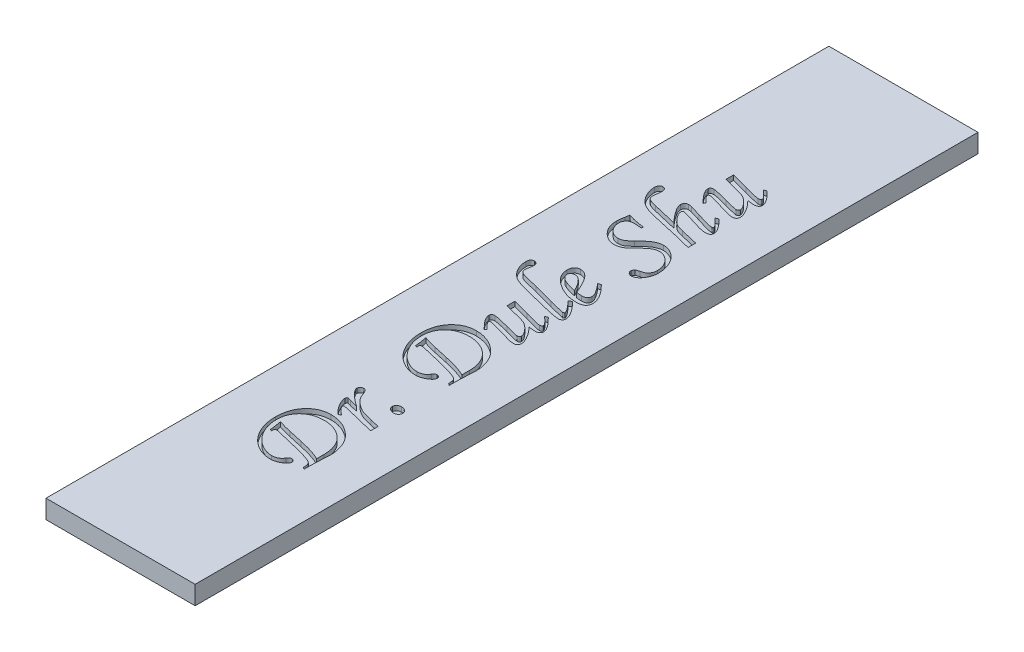
from build123d import *

# Parameters (mm, degrees)
BOSS_EXTRUDE1_DEPTH      = 66.675
BOSS_EXTRUDE1_DEPTH_BACK = 66.675
SKETCH3_W                = 25.4
SKETCH3_H                = 3.175
CUT_EXTRUDE1_DEPTH       = 0.79375


with BuildPart() as part:
    # Sketch3 → Boss-Extrude1 (new, two sides: drawn at the far end of the back side and taken through both)
    with BuildSketch(Plane.XY.offset(-BOSS_EXTRUDE1_DEPTH_BACK)):
        Rectangle(SKETCH3_W, SKETCH3_H)
    extrude(amount=BOSS_EXTRUDE1_DEPTH + BOSS_EXTRUDE1_DEPTH_BACK)

    # Sketch4 → Cut-Extrude1 (cut)
    # profile 1 of 10: a face of its own
    with BuildSketch(Plane(origin=(0, 1.5875, 0), x_dir=(1, 0, 0), z_dir=(0, 1, 0))):
        with BuildLine():
            Line((-3.408527516, -37.535944472), (-3.725830441, -37.449181953))
            add(Edge.make_bspline(
                [(-3.725830441, -37.449181953), (-3.737850592, -37.29867227), (-3.763000795, -36.983755333), (-3.827011478, -36.493640163), (-3.911149001, -35.964545373), (-3.981705302, -35.600529781), (-4.018344075, -35.411502231)],
                knots=[0, 0, 0, 0, 0.879460652, 1.84012782, 2.878412481, 4, 4, 4, 4], degree=3))
            add(Edge.make_bspline(
                [(-4.018344075, -35.411502231), (-3.852567386, -35.467816467), (-3.512771298, -35.583244983), (-2.983413328, -35.742543659), (-2.421475709, -35.887661926), (-2.03462658, -35.974468295), (-1.836886465, -36.018839861)],
                knots=[0, 0, 0, 0, 0.9271626, 1.900425364, 2.926790578, 4, 4, 4, 4], degree=3))
            Line((-1.836886465, -36.018839861), (0.577590481, -36.54685176))
            add(Edge.make_bspline(
                [(0.577590481, -36.54685176), (0.788536521, -36.593774595), (1.199033587, -36.685085557), (1.792102448, -36.834452313), (2.346957761, -36.983710896), (2.859476633, -37.143590841), (3.333976279, -37.303332273), (3.767604051, -37.468800118), (4.161898292, -37.639089729), (4.406460781, -37.763624395), (4.524045612, -37.823500248)],
                knots=[0, 0, 0, 0, 1.246806401, 2.42626203, 3.528511125, 4.561511712, 5.523423198, 6.416823405, 7.238813961, 8, 8, 8, 8], degree=3))
            add(Edge.make_bspline(
                [(4.524045612, -37.823500248), (4.524045612, -37.704511651), (4.524045612, -37.473144935), (4.524045612, -37.136836886), (4.524045612, -36.82201289), (4.524045612, -36.619567014), (4.524045612, -36.522062469)],
                knots=[0, 0, 0, 0, 1.097142857, 2.133333333, 3.100952381, 4, 4, 4, 4], degree=3))
            add(Edge.make_bspline(
                [(4.524045612, -36.522062469), (4.522291504, -36.398871605), (4.518848614, -36.15707776), (4.487231277, -35.800543256), (4.44136888, -35.456021361), (4.375193579, -35.122650278), (4.284886475, -34.802787757), (4.177549251, -34.494299398), (4.055800786, -34.195889359), (3.907414037, -33.913330535), (3.743873397, -33.642347386), (3.56312188, -33.384228219), (3.364145754, -33.14077891), (3.147852002, -32.911290023), (2.911737357, -32.698330533), (2.657510154, -32.49984924), (2.387420669, -32.313396621), (2.100574847, -32.143379402), (1.801144808, -31.989634584), (1.492341348, -31.856023252), (1.175713565, -31.744285753), (0.852102165, -31.651907883), (0.519954027, -31.580553236), (0.180693286, -31.528066793), (-0.166362662, -31.497971264), (-0.399876841, -31.49421631), (-0.518096182, -31.49231532)],
                knots=[0, 0, 0, 0, 1.108876087, 2.176455327, 3.220153502, 4.237073672, 5.233431218, 6.20981358, 7.176940925, 8.131888172, 9.079855142, 10.025132673, 10.966273431, 11.908266498, 12.861589586, 13.825966148, 14.810280397, 15.814384495, 16.825847582, 17.838841615, 18.841207958, 19.846744131, 20.866707514, 21.897815126, 22.93574381, 24, 24, 24, 24], degree=3))
            add(Edge.make_bspline(
                [(-0.518096182, -31.49231532), (-0.67114676, -31.495346054), (-0.969909313, -31.501262202), (-1.406481222, -31.556287875), (-1.821001828, -31.636600992), (-2.210609366, -31.761721225), (-2.579874473, -31.912805401), (-2.922877879, -32.106678221), (-3.245344871, -32.330220619), (-3.54122126, -32.587776106), (-3.809414774, -32.871448638), (-4.040604685, -33.181021204), (-4.23744301, -33.509941411), (-4.401048965, -33.859714565), (-4.523555491, -34.233067211), (-4.612408779, -34.626474818), (-4.669068889, -35.040498073), (-4.674806188, -35.323725687), (-4.677739217, -35.4685176)],
                knots=[0, 0, 0, 0, 1.133342806, 2.212343105, 3.255656027, 4.256658692, 5.238973399, 6.206391602, 7.169305645, 8.141419189, 9.107209001, 10.056087474, 10.997829931, 11.942750604, 12.910691636, 13.902724951, 14.927828886, 16, 16, 16, 16], degree=3))
            add(Edge.make_bspline(
                [(-4.677739217, -35.4685176), (-4.674886497, -35.592511852), (-4.669209826, -35.839249979), (-4.638083085, -36.206433468), (-4.578467951, -36.567511221), (-4.504462768, -36.924582058), (-4.399435249, -37.275053052), (-4.280777617, -37.622761973), (-4.131702221, -37.962113393), (-3.967967521, -38.296120367), (-3.781245751, -38.616921235), (-3.582011131, -38.924412355), (-3.365322185, -39.213037713), (-3.133629469, -39.483140164), (-2.89107149, -39.739590838), (-2.633457153, -39.978260143), (-2.35850353, -40.196377496), (-2.073887366, -40.398981234), (-1.781160346, -40.57734734), (-1.489336729, -40.735167819), (-1.199345173, -40.870122535), (-0.909891874, -40.978585142), (-0.623499224, -41.06442025), (-0.338947361, -41.123316867), (-0.056471082, -41.162881493), (0.132080508, -41.16767664), (0.225582548, -41.170054536)],
                knots=[0, 0, 0, 0, 1.081103213, 2.151304428, 3.208849041, 4.269895994, 5.327636848, 6.396091191, 7.470574728, 8.556204061, 9.637307273, 10.704206439, 11.748692769, 12.780810486, 13.804928832, 14.824451564, 15.839178917, 16.862460927, 17.868096616, 18.825302841, 19.753529844, 20.653949094, 21.51778112, 22.356964132, 23.185224557, 24, 24, 24, 24], degree=3))
            add(Edge.make_bspline(
                [(0.225582548, -41.170054536), (0.313291814, -41.16687255), (0.483848541, -41.160684959), (0.731848054, -41.122085783), (0.960885993, -41.050975683), (1.174699338, -40.958266355), (1.366328781, -40.832162663), (1.540483057, -40.68044595), (1.697321785, -40.502432445), (1.783302472, -40.366506303), (1.826970749, -40.297471492)],
                knots=[0, 0, 0, 0, 1.098234064, 2.135592027, 3.130352065, 4.093468783, 5.043160056, 5.989012807, 6.978650325, 8, 8, 8, 8], degree=3))
            add(Edge.make_bspline(
                [(1.826970749, -40.297471492), (1.851737867, -40.258824693), (1.897773099, -40.186990966), (1.972921894, -40.097578752), (2.036388274, -40.023859172), (2.120912859, -39.960360023), (2.238680046, -39.907814576), (2.339448541, -39.90323742), (2.392166584, -39.900842836)],
                knots=[0, 0, 0, 0, 1.132523627, 2.10504862, 2.885165995, 3.526260391, 4.70583846, 6, 6, 6, 6], degree=3))
            add(Edge.make_bspline(
                [(2.392166584, -39.900842836), (2.427050837, -39.902852156), (2.495439811, -39.906791336), (2.595113576, -39.935167494), (2.68822533, -39.98361114), (2.77293391, -40.049174133), (2.844268814, -40.127382378), (2.897436056, -40.212892993), (2.932832918, -40.304723313), (2.935952492, -40.369041642), (2.937530987, -40.401586515)],
                knots=[0, 0, 0, 0, 1.025470684, 2.010388118, 3.021353536, 4.095777109, 5.145446822, 6.116774371, 7.047093735, 8, 8, 8, 8], degree=3))
            add(Edge.make_bspline(
                [(2.937530987, -40.401586515), (2.929810836, -40.474830423), (2.913602905, -40.628601014), (2.788462926, -40.846509367), (2.59867269, -41.058963271), (2.434600287, -41.180551402), (2.345066931, -41.246901339)],
                knots=[0, 0, 0, 0, 0.817900186, 1.717125675, 2.754248756, 4, 4, 4, 4], degree=3))
            add(Edge.make_bspline(
                [(2.345066931, -41.246901339), (2.207510224, -41.331818795), (1.939582152, -41.497218002), (1.511392389, -41.674192801), (1.077285493, -41.784332434), (0.784790942, -41.797915983), (0.639563708, -41.804660387)],
                knots=[0, 0, 0, 0, 1.064484062, 2.073364277, 3.043401066, 4, 4, 4, 4], degree=3))
            add(Edge.make_bspline(
                [(0.639563708, -41.804660387), (0.517955065, -41.80276379), (0.275640518, -41.798984677), (-0.085285631, -41.753388026), (-0.443437561, -41.687646188), (-0.798884293, -41.592782785), (-1.150403836, -41.470587688), (-1.500130148, -41.324558443), (-1.843834405, -41.146585167), (-2.185113654, -40.94732544), (-2.516110901, -40.723780883), (-2.828760157, -40.473512306), (-3.126883061, -40.206270523), (-3.407974694, -39.917566336), (-3.671663482, -39.607783277), (-3.913549565, -39.273400025), (-4.143074168, -38.92121927), (-4.352287289, -38.548488579), (-4.540935034, -38.159712028), (-4.704289026, -37.757895301), (-4.84313475, -37.345590345), (-4.958312668, -36.923740584), (-5.043570711, -36.490128269), (-5.109267952, -36.046942712), (-5.146567912, -35.59145775), (-5.151299479, -35.284315321), (-5.153693604, -35.128904313)],
                knots=[0, 0, 0, 0, 0.892528231, 1.77843094, 2.667466219, 3.565321182, 4.47685171, 5.398745436, 6.345876364, 7.316869007, 8.299771953, 9.2758895, 10.255546583, 11.238224728, 12.232747284, 13.240126893, 14.266839875, 15.318322956, 16.376769289, 17.438255268, 18.501335748, 19.5700127, 20.64701274, 21.744603105, 22.858791653, 24, 24, 24, 24], degree=3))
            add(Edge.make_bspline(
                [(-5.153693604, -35.128904313), (-5.14977349, -34.940375507), (-5.142120885, -34.572341236), (-5.085781584, -34.034700155), (-4.986129604, -33.527449983), (-4.849873958, -33.049584228), (-4.677555954, -32.599555222), (-4.458934254, -32.181893078), (-4.207349884, -31.789954309), (-3.913199846, -31.434525486), (-3.593766724, -31.112845854), (-3.248487499, -30.833827019), (-2.886296789, -30.593513649), (-2.501930483, -30.398979529), (-2.096653086, -30.2493039), (-1.671801336, -30.143829132), (-1.227511505, -30.077151755), (-0.924878971, -30.068733862), (-0.770946951, -30.064452157)],
                knots=[0, 0, 0, 0, 1.203585055, 2.349564275, 3.446287516, 4.499949565, 5.518843974, 6.516943418, 7.504671405, 8.486846783, 9.456760527, 10.394399883, 11.316233178, 12.226949029, 13.138336972, 14.068555797, 15.017583784, 16, 16, 16, 16], degree=3))
            add(Edge.make_bspline(
                [(-0.770946951, -30.064452157), (-0.626223132, -30.067242763), (-0.339385663, -30.072773647), (0.085589133, -30.119035357), (0.502675673, -30.192744197), (0.90973836, -30.300240705), (1.309963128, -30.433677524), (1.698178573, -30.60136051), (2.08040968, -30.794560762), (2.44779816, -31.019871753), (2.799862341, -31.262785403), (3.128112562, -31.520715777), (3.4290476, -31.792046677), (3.704926756, -32.074388284), (3.954840911, -32.370119932), (4.174145149, -32.681107468), (4.372460873, -33.000964977), (4.59273138, -33.441794591), (4.8187842, -34.001920733), (5.012051561, -34.683503626), (5.13497266, -35.364934129), (5.150792514, -35.820027765), (5.158651463, -36.046108081)],
                knots=[0, 0, 0, 0, 0.926951201, 1.837184367, 2.735392543, 3.638035727, 4.531975, 5.435611123, 6.344735262, 7.273498627, 8.194216139, 9.083818774, 9.945937045, 10.78824293, 11.611093864, 12.42340477, 13.224180136, 14.019653575, 15.577753707, 17.085869658, 18.552325372, 20, 20, 20, 20], degree=3))
            add(Edge.make_bspline(
                [(5.158651463, -36.046108081), (5.157729345, -36.085768304), (5.155731486, -36.171696123), (5.1546833, -36.310610966), (5.145834087, -36.469207248), (5.13620562, -36.648526025), (5.123620848, -36.847660094), (5.109434914, -37.067579467), (5.088160035, -37.306145162), (5.075802571, -37.472301589), (5.069410015, -37.558254834)],
                knots=[0, 0, 0, 0, 0.628413, 1.361519305, 2.200141354, 3.144009582, 4.206244464, 5.360759236, 6.634712408, 8, 8, 8, 8], degree=3))
            add(Edge.make_bspline(
                [(5.069410015, -37.558254834), (5.049170124, -37.853132617), (5.009796502, -38.426772401), (5.003203762, -39.001715304), (5, -39.28111056)],
                knots=[0, 0, 0, 0, 1.028093904, 2, 2, 2, 2], degree=3))
            add(Edge.make_bspline(
                [(5, -39.28111056), (5, -39.352173195), (5, -39.510824657), (5, -39.773591142), (5, -40.085936209), (5, -40.310692448), (5, -40.431333664)],
                knots=[0, 0, 0, 0, 0.74137931, 1.655172414, 2.74137931, 4, 4, 4, 4], degree=3))
            Line((5, -40.431333664), (4.682697075, -40.250371839))
            add(Edge.make_bspline(
                [(4.682697075, -40.250371839), (4.675446442, -40.13379801), (4.6624123, -39.924238415), (4.63204999, -39.646605206), (4.594788937, -39.441558811), (4.550681406, -39.296027371), (4.487648725, -39.193758344), (4.416375945, -39.106347901), (4.324321365, -39.028883935), (4.255208826, -38.984495892), (4.219137333, -38.961328706)],
                knots=[0, 0, 0, 0, 1.944688049, 3.495879345, 4.645273665, 5.415328289, 6.0075428, 6.632868811, 7.286461394, 8, 8, 8, 8], degree=3))
            add(Edge.make_bspline(
                [(4.219137333, -38.961328706), (4.181438106, -38.939253503), (4.097144421, -38.889894396), (3.95084284, -38.823299797), (3.77680793, -38.748055338), (3.572629733, -38.669968274), (3.340144159, -38.582523346), (3.077750347, -38.491945583), (2.78638996, -38.394181278), (2.581525555, -38.330440021), (2.473971244, -38.296975706)],
                knots=[0, 0, 0, 0, 0.560225601, 1.252637882, 2.060094579, 2.993348988, 4.056820397, 5.24717586, 6.554760623, 8, 8, 8, 8], degree=3))
            Line((2.473971244, -38.296975706), (0.146256817, -37.70699058))
            Line((0.146256817, -37.70699058), (-2.759048091, -37.020327219))
            add(Edge.make_bspline(
                [(-2.759048091, -37.020327219), (-2.824845168, -37.004856763), (-2.944827448, -36.976646079), (-3.067879242, -36.970875678), (-3.123450669, -36.968269707)],
                knots=[0, 0, 0, 0, 1.096779889, 2, 2, 2, 2], degree=3))
            add(Edge.make_bspline(
                [(-3.123450669, -36.968269707), (-3.167468144, -36.972028056), (-3.251277883, -36.979183993), (-3.358274302, -37.048884945), (-3.426136176, -37.160686475), (-3.430796311, -37.248171122), (-3.433316807, -37.295488349)],
                knots=[0, 0, 0, 0, 1.029367958, 1.959927517, 2.89659986, 4, 4, 4, 4], degree=3))
            add(Edge.make_bspline(
                [(-3.433316807, -37.295488349), (-3.431009043, -37.325252447), (-3.424778833, -37.405605783), (-3.414806159, -37.485588543), (-3.408527516, -37.535944472)],
                knots=[0, 0, 0, 0, 0.740830417, 2, 2, 2, 2], degree=3))
        make_face()
    # profile 2 of 10: a face of its own
    with BuildSketch(Plane(origin=(0, 1.5875, 0), x_dir=(1, 0, 0), z_dir=(0, 1, 0))):
        with BuildLine():
            Line((5, -27.811105602), (5, -29.112543381))
            Line((5, -29.112543381), (2.749132375, -28.522558255))
            add(Edge.make_bspline(
                [(2.749132375, -28.522558255), (2.476621804, -28.452460344), (1.939749329, -28.314360606), (1.142714053, -28.12194661), (0.367317965, -27.939379936), (-0.144436977, -27.828542235), (-0.396628656, -27.773921666)],
                knots=[0, 0, 0, 0, 1.044120099, 2.057018701, 3.042503205, 4, 4, 4, 4], degree=3))
            add(Edge.make_bspline(
                [(-0.396628656, -27.773921666), (-0.451860919, -27.761621845), (-0.551268676, -27.739484464), (-0.684191352, -27.719641858), (-0.78209306, -27.701676176), (-0.836185817, -27.698384593), (-0.85770947, -27.697074864)],
                knots=[0, 0, 0, 0, 1.4507061, 2.611000006, 3.447313195, 4, 4, 4, 4], degree=3))
            add(Edge.make_bspline(
                [(-0.85770947, -27.697074864), (-0.882965949, -27.699127826), (-0.929877338, -27.702941), (-0.992941333, -27.740900028), (-1.025226576, -27.810341554), (-1.027505527, -27.862061771), (-1.028755578, -27.890431334)],
                knots=[0, 0, 0, 0, 1.023146048, 1.900391694, 2.848323326, 4, 4, 4, 4], degree=3))
            add(Edge.make_bspline(
                [(-1.028755578, -27.890431334), (-1.025900082, -27.915583565), (-1.019136089, -27.975163254), (-0.97085575, -28.06656557), (-0.906284825, -28.178720764), (-0.829226914, -28.281114501), (-0.749073371, -28.378888151), (-0.663675813, -28.465699715), (-0.563963289, -28.571833876), (-0.436776616, -28.683285411), (-0.297784043, -28.816386632), (-0.13501972, -28.959237142), (0.044873624, -29.118290189), (0.173300729, -29.226832163), (0.240456123, -29.283589489)],
                knots=[0, 0, 0, 0, 0.473246814, 1.121009778, 1.916259303, 2.918417322, 3.526064876, 4.296572721, 5.209868489, 6.267050422, 7.4781545, 8.833684422, 10.344312357, 12, 12, 12, 12], degree=3))
            Line((0.240456123, -29.283589489), (-0.235498265, -29.442240952))
            add(Edge.make_bspline(
                [(-0.235498265, -29.442240952), (-0.374013032, -29.305464495), (-0.642303469, -29.040541009), (-0.996377951, -28.622430021), (-1.301202587, -28.207925306), (-1.541866417, -27.795551094), (-1.730539618, -27.409589999), (-1.868611279, -27.067355962), (-1.960100433, -26.772955046), (-1.974297976, -26.589467343), (-1.980664353, -26.507188894)],
                knots=[0, 0, 0, 0, 1.341953613, 2.599241416, 3.774513272, 4.885797771, 5.887458592, 6.73406582, 7.432337434, 8, 8, 8, 8], degree=3))
            add(Edge.make_bspline(
                [(-1.980664353, -26.507188894), (-1.978954767, -26.459601535), (-1.9758845, -26.374138826), (-1.939867575, -26.264418095), (-1.881926358, -26.184035065), (-1.826688974, -26.172633992), (-1.802181458, -26.167575607)],
                knots=[0, 0, 0, 0, 1.353899392, 2.431484129, 3.304086744, 4, 4, 4, 4], degree=3))
            add(Edge.make_bspline(
                [(-1.802181458, -26.167575607), (-1.777353429, -26.169748149), (-1.713264523, -26.175356158), (-1.596651959, -26.196965138), (-1.437283458, -26.232339621), (-1.317064111, -26.262274176), (-1.249380268, -26.279127417)],
                knots=[0, 0, 0, 0, 0.529538259, 1.366903866, 2.517559208, 4, 4, 4, 4], degree=3))
            Line((-1.249380268, -26.279127417), (0.185919683, -26.646008924))
            add(Edge.make_bspline(
                [(0.185919683, -26.646008924), (-0.023585026, -26.507650879), (-0.435525148, -26.235603391), (-1.009207574, -25.78243006), (-1.540690468, -25.309105034), (-1.860052384, -24.96617076), (-2.01784829, -24.796727814)],
                knots=[0, 0, 0, 0, 1.043677459, 2.052138213, 3.037566479, 4, 4, 4, 4], degree=3))
            add(Edge.make_bspline(
                [(-2.01784829, -24.796727814), (-2.083332269, -24.718749109), (-2.204319047, -24.574677349), (-2.344669045, -24.35736779), (-2.436896974, -24.158323409), (-2.450439534, -24.02815761), (-2.456618741, -23.968765493)],
                knots=[0, 0, 0, 0, 1.279146713, 2.363323658, 3.253216489, 4, 4, 4, 4], degree=3))
            add(Edge.make_bspline(
                [(-2.456618741, -23.968765493), (-2.453883207, -23.929766018), (-2.448547746, -23.853700367), (-2.417032997, -23.743739344), (-2.355999432, -23.648215776), (-2.280416198, -23.560991611), (-2.187195464, -23.49173401), (-2.086235253, -23.43645403), (-1.975685467, -23.406972282), (-1.89983507, -23.403059298), (-1.861675756, -23.401090729)],
                knots=[0, 0, 0, 0, 1.02716901, 2.003418691, 2.968722159, 3.984796309, 5.023623781, 6.005421064, 6.99655419, 8, 8, 8, 8], degree=3))
            add(Edge.make_bspline(
                [(-1.861675756, -23.401090729), (-1.821869499, -23.403020534), (-1.743574198, -23.406816285), (-1.630400641, -23.435998069), (-1.529097993, -23.491144198), (-1.42974173, -23.567212398), (-1.334766273, -23.688742093), (-1.237717657, -23.863290427), (-1.132199974, -24.09764733), (-1.065565718, -24.276505123), (-1.028755578, -24.375309866)],
                knots=[0, 0, 0, 0, 0.693177916, 1.363418161, 2.013581126, 2.690126397, 3.528536773, 4.676329381, 6.163935612, 8, 8, 8, 8], degree=3))
            add(Edge.make_bspline(
                [(-1.028755578, -24.375309866), (-0.992147421, -24.474208951), (-0.921649995, -24.664661889), (-0.797260717, -24.930689552), (-0.66338313, -25.168563093), (-0.512948419, -25.384983609), (-0.331526013, -25.587360657), (-0.120645105, -25.797328658), (0.135324987, -26.011006407), (0.41635967, -26.231352542), (0.706643548, -26.437026809), (0.981437412, -26.616712747), (1.23170012, -26.761758712), (1.433299647, -26.860604151), (1.604863375, -26.929364363), (1.765135114, -26.982032141), (1.960313587, -27.041890379), (2.190286229, -27.10800711), (2.455895435, -27.183292035), (2.757035257, -27.261377394), (3.093482934, -27.345950085), (3.329172568, -27.403851511), (3.45314824, -27.434308379)],
                knots=[0, 0, 0, 0, 1.110708496, 2.138924714, 3.090259246, 3.983917359, 4.909365599, 5.949746143, 7.116886804, 8.419515261, 9.711892046, 10.863736856, 11.877701499, 12.757685161, 13.226511401, 13.823927962, 14.534404968, 15.377483492, 16.344934113, 17.442980541, 18.654976029, 20, 20, 20, 20], degree=3))
            Line((3.45314824, -27.434308379), (5, -27.811105602))
        make_face()
    # profile 3 of 10: a face of its own
    with BuildSketch(Plane(origin=(0, 1.5875, 0), x_dir=(1, 0, 0), z_dir=(0, 1, 0))):
        with BuildLine():
            add(Edge.make_bspline(
                [(3.254833912, -23.651462568), (3.257621138, -23.601540244), (3.263025186, -23.504747713), (3.307683108, -23.365894019), (3.380155069, -23.239790122), (3.483912564, -23.131509338), (3.606712714, -23.039937096), (3.747767046, -22.97189364), (3.90452123, -22.931061738), (4.013962432, -22.927152399), (4.070401587, -22.925136341)],
                knots=[0, 0, 0, 0, 0.98159276, 1.903173577, 2.844104295, 3.823129028, 4.835684381, 5.847716179, 6.890060819, 8, 8, 8, 8], degree=3))
            add(Edge.make_bspline(
                [(4.070401587, -22.925136341), (4.150830493, -22.927421975), (4.304147742, -22.931778954), (4.520286408, -22.979936256), (4.710166176, -23.05629122), (4.869846914, -23.163516), (4.998426406, -23.293387733), (5.092250042, -23.441930904), (5.150185462, -23.6085148), (5.155780282, -23.725360969), (5.158651463, -23.78532474)],
                knots=[0, 0, 0, 0, 1.24009155, 2.36391907, 3.399451324, 4.383300886, 5.312685463, 6.201320917, 7.07694382, 8, 8, 8, 8], degree=3))
            add(Edge.make_bspline(
                [(5.158651463, -23.78532474), (5.156991741, -23.835301584), (5.153771406, -23.93227096), (5.107487951, -24.069722515), (5.040636139, -24.196180429), (4.945762364, -24.307440347), (4.830364042, -24.398728627), (4.697014964, -24.46487502), (4.548772793, -24.505825432), (4.444167504, -24.509667946), (4.390183441, -24.511650967)],
                knots=[0, 0, 0, 0, 1.010157701, 1.959994936, 2.913381871, 3.901564746, 4.905152474, 5.880576668, 6.906220855, 8, 8, 8, 8], degree=3))
            add(Edge.make_bspline(
                [(4.390183441, -24.511650967), (4.310399291, -24.509043417), (4.153618082, -24.503919406), (3.928962128, -24.44174005), (3.714939161, -24.355889092), (3.591982139, -24.264971959), (3.529995042, -24.219137333)],
                knots=[0, 0, 0, 0, 1.030978626, 2.025942206, 3.004805837, 4, 4, 4, 4], degree=3))
            add(Edge.make_bspline(
                [(3.529995042, -24.219137333), (3.487337518, -24.182247478), (3.405119037, -24.111145653), (3.318447451, -23.972601483), (3.263752641, -23.818284701), (3.257863637, -23.708132667), (3.254833912, -23.651462568)],
                knots=[0, 0, 0, 0, 1.029763566, 1.984775184, 2.963223966, 4, 4, 4, 4], degree=3))
        make_face()
    # profile 4 of 10: a face of its own
    with BuildSketch(Plane(origin=(0, 1.5875, 0), x_dir=(1, 0, 0), z_dir=(0, 1, 0))):
        with BuildLine():
            Line((-3.408527516, -12.786316311), (-3.725830441, -12.699553793))
            add(Edge.make_bspline(
                [(-3.725830441, -12.699553793), (-3.737850592, -12.54904411), (-3.763000795, -12.234127172), (-3.827011478, -11.744012002), (-3.911149001, -11.214917213), (-3.981705302, -10.85090162), (-4.018344075, -10.66187407)],
                knots=[0, 0, 0, 0, 0.879460652, 1.84012782, 2.878412481, 4, 4, 4, 4], degree=3))
            add(Edge.make_bspline(
                [(-4.018344075, -10.66187407), (-3.852567386, -10.718188307), (-3.512771298, -10.833616822), (-2.983413328, -10.992915499), (-2.421475709, -11.138033765), (-2.03462658, -11.224840135), (-1.836886465, -11.269211701)],
                knots=[0, 0, 0, 0, 0.9271626, 1.900425364, 2.926790578, 4, 4, 4, 4], degree=3))
            Line((-1.836886465, -11.269211701), (0.577590481, -11.797223599))
            add(Edge.make_bspline(
                [(0.577590481, -11.797223599), (0.788536521, -11.844146434), (1.199033587, -11.935457397), (1.792102448, -12.084824152), (2.346957761, -12.234082735), (2.859476633, -12.39396268), (3.333976279, -12.553704113), (3.767604051, -12.719171957), (4.161898292, -12.889461568), (4.406460781, -13.013996234), (4.524045612, -13.073872087)],
                knots=[0, 0, 0, 0, 1.246806401, 2.42626203, 3.528511125, 4.561511712, 5.523423198, 6.416823405, 7.238813961, 8, 8, 8, 8], degree=3))
            add(Edge.make_bspline(
                [(4.524045612, -13.073872087), (4.524045612, -12.95488349), (4.524045612, -12.723516774), (4.524045612, -12.387208726), (4.524045612, -12.07238473), (4.524045612, -11.869938853), (4.524045612, -11.772434308)],
                knots=[0, 0, 0, 0, 1.097142857, 2.133333333, 3.100952381, 4, 4, 4, 4], degree=3))
            add(Edge.make_bspline(
                [(4.524045612, -11.772434308), (4.522291504, -11.649243444), (4.518848614, -11.407449599), (4.487231277, -11.050915095), (4.44136888, -10.7063932), (4.375193579, -10.373022118), (4.284886475, -10.053159597), (4.177549251, -9.744671237), (4.055800786, -9.446261199), (3.907414037, -9.163702375), (3.743873397, -8.892719226), (3.56312188, -8.634600058), (3.364145754, -8.391150749), (3.147852002, -8.161661862), (2.911737357, -7.948702373), (2.657510154, -7.750221079), (2.387420669, -7.56376846), (2.100574847, -7.393751242), (1.801144808, -7.240006423), (1.492341348, -7.106395091), (1.175713565, -6.994657593), (0.852102165, -6.902279723), (0.519954027, -6.830925075), (0.180693286, -6.778438632), (-0.166362662, -6.748343103), (-0.399876841, -6.744588149), (-0.518096182, -6.742687159)],
                knots=[0, 0, 0, 0, 1.108876087, 2.176455327, 3.220153502, 4.237073672, 5.233431218, 6.20981358, 7.176940925, 8.131888172, 9.079855142, 10.025132673, 10.966273431, 11.908266498, 12.861589586, 13.825966148, 14.810280397, 15.814384495, 16.825847582, 17.838841615, 18.841207958, 19.846744131, 20.866707514, 21.897815126, 22.93574381, 24, 24, 24, 24], degree=3))
            add(Edge.make_bspline(
                [(-0.518096182, -6.742687159), (-0.67114676, -6.745717893), (-0.969909313, -6.751634042), (-1.406481222, -6.806659715), (-1.821001828, -6.886972832), (-2.210609366, -7.012093064), (-2.579874473, -7.16317724), (-2.922877879, -7.35705006), (-3.245344871, -7.580592459), (-3.54122126, -7.838147946), (-3.809414774, -8.121820478), (-4.040604685, -8.431393043), (-4.23744301, -8.76031325), (-4.401048965, -9.110086404), (-4.523555491, -9.48343905), (-4.612408779, -9.876846657), (-4.669068889, -10.290869913), (-4.674806188, -10.574097527), (-4.677739217, -10.71888944)],
                knots=[0, 0, 0, 0, 1.133342806, 2.212343105, 3.255656027, 4.256658692, 5.238973399, 6.206391602, 7.169305645, 8.141419189, 9.107209001, 10.056087474, 10.997829931, 11.942750604, 12.910691636, 13.902724951, 14.927828886, 16, 16, 16, 16], degree=3))
            add(Edge.make_bspline(
                [(-4.677739217, -10.71888944), (-4.674886497, -10.842883691), (-4.669209826, -11.089621818), (-4.638083085, -11.456805307), (-4.578467951, -11.81788306), (-4.504462768, -12.174953897), (-4.399435249, -12.525424891), (-4.280777617, -12.873133813), (-4.131702221, -13.212485232), (-3.967967521, -13.546492207), (-3.781245751, -13.867293075), (-3.582011131, -14.174784194), (-3.365322185, -14.463409552), (-3.133629469, -14.733512003), (-2.89107149, -14.989962677), (-2.633457153, -15.228631982), (-2.35850353, -15.446749335), (-2.073887366, -15.649353073), (-1.781160346, -15.827719179), (-1.489336729, -15.985539658), (-1.199345173, -16.120494374), (-0.909891874, -16.228956981), (-0.623499224, -16.314792089), (-0.338947361, -16.373688707), (-0.056471082, -16.413253332), (0.132080508, -16.41804848), (0.225582548, -16.420426376)],
                knots=[0, 0, 0, 0, 1.081103213, 2.151304428, 3.208849041, 4.269895994, 5.327636848, 6.396091191, 7.470574728, 8.556204061, 9.637307273, 10.704206439, 11.748692769, 12.780810486, 13.804928832, 14.824451564, 15.839178917, 16.862460927, 17.868096616, 18.825302841, 19.753529844, 20.653949094, 21.51778112, 22.356964132, 23.185224557, 24, 24, 24, 24], degree=3))
            add(Edge.make_bspline(
                [(0.225582548, -16.420426376), (0.313291814, -16.41724439), (0.483848541, -16.411056798), (0.731848054, -16.372457623), (0.960885993, -16.301347522), (1.174699338, -16.208638194), (1.366328781, -16.082534503), (1.540483057, -15.93081779), (1.697321785, -15.752804285), (1.783302472, -15.616878143), (1.826970749, -15.547843332)],
                knots=[0, 0, 0, 0, 1.098234064, 2.135592027, 3.130352065, 4.093468783, 5.043160056, 5.989012807, 6.978650325, 8, 8, 8, 8], degree=3))
            add(Edge.make_bspline(
                [(1.826970749, -15.547843332), (1.851737867, -15.509196532), (1.897773099, -15.437362805), (1.972921894, -15.347950591), (2.036388274, -15.274231011), (2.120912859, -15.210731862), (2.238680046, -15.158186415), (2.339448541, -15.15360926), (2.392166584, -15.151214675)],
                knots=[0, 0, 0, 0, 1.132523627, 2.10504862, 2.885165995, 3.526260391, 4.70583846, 6, 6, 6, 6], degree=3))
            add(Edge.make_bspline(
                [(2.392166584, -15.151214675), (2.427050837, -15.153223995), (2.495439811, -15.157163175), (2.595113576, -15.185539334), (2.68822533, -15.233982979), (2.77293391, -15.299545972), (2.844268814, -15.377754217), (2.897436056, -15.463264832), (2.932832918, -15.555095153), (2.935952492, -15.619413481), (2.937530987, -15.651958354)],
                knots=[0, 0, 0, 0, 1.025470684, 2.010388118, 3.021353536, 4.095777109, 5.145446822, 6.116774371, 7.047093735, 8, 8, 8, 8], degree=3))
            add(Edge.make_bspline(
                [(2.937530987, -15.651958354), (2.929810836, -15.725202262), (2.913602905, -15.878972853), (2.788462926, -16.096881206), (2.59867269, -16.30933511), (2.434600287, -16.430923242), (2.345066931, -16.497273178)],
                knots=[0, 0, 0, 0, 0.817900186, 1.717125675, 2.754248756, 4, 4, 4, 4], degree=3))
            add(Edge.make_bspline(
                [(2.345066931, -16.497273178), (2.207510224, -16.582190634), (1.939582152, -16.747589841), (1.511392389, -16.92456464), (1.077285493, -17.034704273), (0.784790942, -17.048287823), (0.639563708, -17.055032226)],
                knots=[0, 0, 0, 0, 1.064484062, 2.073364277, 3.043401066, 4, 4, 4, 4], degree=3))
            add(Edge.make_bspline(
                [(0.639563708, -17.055032226), (0.517955065, -17.05313563), (0.275640518, -17.049356516), (-0.085285631, -17.003759865), (-0.443437561, -16.938018027), (-0.798884293, -16.843154625), (-1.150403836, -16.720959528), (-1.500130148, -16.574930282), (-1.843834405, -16.396957006), (-2.185113654, -16.19769728), (-2.516110901, -15.974152722), (-2.828760157, -15.723884145), (-3.126883061, -15.456642362), (-3.407974694, -15.167938176), (-3.671663482, -14.858155116), (-3.913549565, -14.523771864), (-4.143074168, -14.171591109), (-4.352287289, -13.798860418), (-4.540935034, -13.410083867), (-4.704289026, -13.00826714), (-4.84313475, -12.595962185), (-4.958312668, -12.174112423), (-5.043570711, -11.740500109), (-5.109267952, -11.297314551), (-5.146567912, -10.84182959), (-5.151299479, -10.53468716), (-5.153693604, -10.379276153)],
                knots=[0, 0, 0, 0, 0.892528231, 1.77843094, 2.667466219, 3.565321182, 4.47685171, 5.398745436, 6.345876364, 7.316869007, 8.299771953, 9.2758895, 10.255546583, 11.238224728, 12.232747284, 13.240126893, 14.266839875, 15.318322956, 16.376769289, 17.438255268, 18.501335748, 19.5700127, 20.64701274, 21.744603105, 22.858791653, 24, 24, 24, 24], degree=3))
            add(Edge.make_bspline(
                [(-5.153693604, -10.379276153), (-5.14977349, -10.190747346), (-5.142120885, -9.822713075), (-5.085781584, -9.285071994), (-4.986129604, -8.777821822), (-4.849873958, -8.299956068), (-4.677555954, -7.849927062), (-4.458934254, -7.432264917), (-4.207349884, -7.040326148), (-3.913199846, -6.684897325), (-3.593766724, -6.363217693), (-3.248487499, -6.084198858), (-2.886296789, -5.843885488), (-2.501930483, -5.649351369), (-2.096653086, -5.49967574), (-1.671801336, -5.394200972), (-1.227511505, -5.327523594), (-0.924878971, -5.319105701), (-0.770946951, -5.314823996)],
                knots=[0, 0, 0, 0, 1.203585055, 2.349564275, 3.446287516, 4.499949565, 5.518843974, 6.516943418, 7.504671405, 8.486846783, 9.456760527, 10.394399883, 11.316233178, 12.226949029, 13.138336972, 14.068555797, 15.017583784, 16, 16, 16, 16], degree=3))
            add(Edge.make_bspline(
                [(-0.770946951, -5.314823996), (-0.626223132, -5.317614603), (-0.339385663, -5.323145486), (0.085589133, -5.369407196), (0.502675673, -5.443116036), (0.90973836, -5.550612545), (1.309963128, -5.684049363), (1.698178573, -5.851732349), (2.08040968, -6.044932601), (2.44779816, -6.270243592), (2.799862341, -6.513157243), (3.128112562, -6.771087616), (3.4290476, -7.042418516), (3.704926756, -7.324760124), (3.954840911, -7.620491771), (4.174145149, -7.931479307), (4.372460873, -8.251336816), (4.59273138, -8.69216643), (4.8187842, -9.252292572), (5.012051561, -9.933875465), (5.13497266, -10.615305969), (5.150792514, -11.070399604), (5.158651463, -11.296479921)],
                knots=[0, 0, 0, 0, 0.926951201, 1.837184367, 2.735392543, 3.638035727, 4.531975, 5.435611123, 6.344735262, 7.273498627, 8.194216139, 9.083818774, 9.945937045, 10.78824293, 11.611093864, 12.42340477, 13.224180136, 14.019653575, 15.577753707, 17.085869658, 18.552325372, 20, 20, 20, 20], degree=3))
            add(Edge.make_bspline(
                [(5.158651463, -11.296479921), (5.157729345, -11.336140143), (5.155731486, -11.422067963), (5.1546833, -11.560982805), (5.145834087, -11.719579088), (5.13620562, -11.898897865), (5.123620848, -12.098031933), (5.109434914, -12.317951307), (5.088160035, -12.556517001), (5.075802571, -12.722673428), (5.069410015, -12.808626673)],
                knots=[0, 0, 0, 0, 0.628413, 1.361519305, 2.200141354, 3.144009582, 4.206244464, 5.360759236, 6.634712408, 8, 8, 8, 8], degree=3))
            add(Edge.make_bspline(
                [(5.069410015, -12.808626673), (5.049170124, -13.103504456), (5.009796502, -13.677144241), (5.003203762, -14.252087143), (5, -14.5314824)],
                knots=[0, 0, 0, 0, 1.028093904, 2, 2, 2, 2], degree=3))
            add(Edge.make_bspline(
                [(5, -14.5314824), (5, -14.602545034), (5, -14.761196496), (5, -15.023962981), (5, -15.336308048), (5, -15.561064287), (5, -15.681705503)],
                knots=[0, 0, 0, 0, 0.74137931, 1.655172414, 2.74137931, 4, 4, 4, 4], degree=3))
            Line((5, -15.681705503), (4.682697075, -15.500743679))
            add(Edge.make_bspline(
                [(4.682697075, -15.500743679), (4.675446442, -15.38416985), (4.6624123, -15.174610254), (4.63204999, -14.896977045), (4.594788937, -14.691930651), (4.550681406, -14.546399211), (4.487648725, -14.444130184), (4.416375945, -14.35671974), (4.324321365, -14.279255774), (4.255208826, -14.234867731), (4.219137333, -14.211700545)],
                knots=[0, 0, 0, 0, 1.944688049, 3.495879345, 4.645273665, 5.415328289, 6.0075428, 6.632868811, 7.286461394, 8, 8, 8, 8], degree=3))
            add(Edge.make_bspline(
                [(4.219137333, -14.211700545), (4.181438106, -14.189625342), (4.097144421, -14.140266235), (3.95084284, -14.073671636), (3.77680793, -13.998427178), (3.572629733, -13.920340114), (3.340144159, -13.832895186), (3.077750347, -13.742317422), (2.78638996, -13.644553117), (2.581525555, -13.580811861), (2.473971244, -13.547347546)],
                knots=[0, 0, 0, 0, 0.560225601, 1.252637882, 2.060094579, 2.993348988, 4.056820397, 5.24717586, 6.554760623, 8, 8, 8, 8], degree=3))
            Line((2.473971244, -13.547347546), (0.146256817, -12.957362419))
            Line((0.146256817, -12.957362419), (-2.759048091, -12.270699058))
            add(Edge.make_bspline(
                [(-2.759048091, -12.270699058), (-2.824845168, -12.255228603), (-2.944827448, -12.227017918), (-3.067879242, -12.221247518), (-3.123450669, -12.218641547)],
                knots=[0, 0, 0, 0, 1.096779889, 2, 2, 2, 2], degree=3))
            add(Edge.make_bspline(
                [(-3.123450669, -12.218641547), (-3.167468144, -12.222399896), (-3.251277883, -12.229555832), (-3.358274302, -12.299256784), (-3.426136176, -12.411058315), (-3.430796311, -12.498542962), (-3.433316807, -12.545860188)],
                knots=[0, 0, 0, 0, 1.029367958, 1.959927517, 2.89659986, 4, 4, 4, 4], degree=3))
            add(Edge.make_bspline(
                [(-3.433316807, -12.545860188), (-3.431009043, -12.575624286), (-3.424778833, -12.655977623), (-3.414806159, -12.735960382), (-3.408527516, -12.786316311)],
                knots=[0, 0, 0, 0, 0.740830417, 2, 2, 2, 2], degree=3))
        make_face()
    # profile 5 of 10: a face of its own
    with BuildSketch(Plane(origin=(0, 1.5875, 0), x_dir=(1, 0, 0), z_dir=(0, 1, 0))):
        with BuildLine():
            Line((-1.82201289, 0.996529499), (-1.82201289, 2.300446207))
            Line((-1.82201289, 2.300446207), (0.99405057, 1.541893902))
            add(Edge.make_bspline(
                [(0.99405057, 1.541893902), (1.187360044, 1.489654761), (1.551523431, 1.391244777), (2.065564855, 1.255248811), (2.512461321, 1.136384244), (2.895462373, 1.04735674), (3.210049221, 0.969547719), (3.460119388, 0.919531274), (3.643814546, 0.881838107), (3.745573217, 0.875182877), (3.78532474, 0.872583044)],
                knots=[0, 0, 0, 0, 1.67290993, 3.151488309, 4.442436646, 5.535809027, 6.436665532, 7.148817491, 7.667489749, 8, 8, 8, 8], degree=3))
            add(Edge.make_bspline(
                [(3.78532474, 0.872583044), (3.846552234, 0.875026421), (3.95628742, 0.879405573), (4.09419568, 0.940218015), (4.186609118, 1.027489607), (4.2004822, 1.10010262), (4.206742687, 1.1328706)],
                knots=[0, 0, 0, 0, 1.339591384, 2.400887249, 3.278370454, 4, 4, 4, 4], degree=3))
            add(Edge.make_bspline(
                [(4.206742687, 1.1328706), (4.204443415, 1.15951004), (4.199528392, 1.216455642), (4.169413822, 1.303775356), (4.125420082, 1.398822333), (4.083021803, 1.459867838), (4.06048587, 1.49231532)],
                knots=[0, 0, 0, 0, 0.812871315, 1.737628382, 2.797482909, 4, 4, 4, 4], degree=3))
            add(Edge.make_bspline(
                [(4.06048587, 1.49231532), (4.038340332, 1.519720298), (3.988589108, 1.581287155), (3.901226065, 1.680772025), (3.791748143, 1.79617923), (3.663469034, 1.930666592), (3.511922181, 2.079186783), (3.336812453, 2.241912573), (3.145346702, 2.425710403), (3.008813488, 2.551878267), (2.937530987, 2.617749132)],
                knots=[0, 0, 0, 0, 0.531412588, 1.193848891, 1.996260431, 2.930596375, 3.99699629, 5.196071906, 6.536099728, 8, 8, 8, 8], degree=3))
            Line((2.937530987, 2.617749132), (3.413485374, 2.776400595))
            add(Edge.make_bspline(
                [(3.413485374, 2.776400595), (3.550794865, 2.639349125), (3.811449678, 2.379184111), (4.167226634, 1.994730872), (4.468929919, 1.638364986), (4.715243662, 1.309232875), (4.910022362, 1.009088551), (5.048319161, 0.735657029), (5.138889285, 0.488981515), (5.152456443, 0.33027638), (5.158651463, 0.257808627)],
                knots=[0, 0, 0, 0, 1.492938749, 2.834047883, 4.030158996, 5.084541994, 5.996611992, 6.778705564, 7.442333965, 8, 8, 8, 8], degree=3))
            add(Edge.make_bspline(
                [(5.158651463, 0.257808627), (5.156536152, 0.213715491), (5.152372652, 0.126928357), (5.11117962, 0.002565298), (5.040834123, -0.10952071), (4.947172612, -0.210189618), (4.82975832, -0.296395034), (4.687871455, -0.355253208), (4.524900694, -0.39015587), (4.409380718, -0.394383735), (4.348041646, -0.396628656)],
                knots=[0, 0, 0, 0, 0.904355969, 1.78001547, 2.656992247, 3.60664427, 4.592088432, 5.627095869, 6.740029697, 8, 8, 8, 8], degree=3))
            add(Edge.make_bspline(
                [(4.348041646, -0.396628656), (4.267008395, -0.39516594), (4.092217606, -0.392010824), (3.811230922, -0.364013475), (3.492093082, -0.324989923), (3.267123872, -0.28914523), (3.14823996, -0.270203272)],
                knots=[0, 0, 0, 0, 0.805062445, 1.73654022, 2.803885414, 4, 4, 4, 4], degree=3))
            add(Edge.make_bspline(
                [(3.14823996, -0.270203272), (3.282799241, -0.401024611), (3.55618687, -0.666817767), (3.928067318, -1.113181109), (4.279198741, -1.600805568), (4.483958198, -1.95238221), (4.588497769, -2.131879028)],
                knots=[0, 0, 0, 0, 0.952428831, 1.935074702, 2.945756124, 4, 4, 4, 4], degree=3))
            add(Edge.make_bspline(
                [(4.588497769, -2.131879028), (4.65127323, -2.249719617), (4.769575358, -2.471793534), (4.900727796, -2.805278054), (4.983664033, -3.115256367), (4.994773136, -3.316378108), (5, -3.411006445)],
                knots=[0, 0, 0, 0, 1.179572191, 2.222937086, 3.163886966, 4, 4, 4, 4], degree=3))
            add(Edge.make_bspline(
                [(5, -3.411006445), (4.997668119, -3.457527978), (4.993182693, -3.547013214), (4.957491257, -3.673560733), (4.899803724, -3.786157987), (4.816551444, -3.881261404), (4.70830411, -3.959623531), (4.571064522, -4.00857986), (4.409160122, -4.042094721), (4.292069094, -4.044381563), (4.229053049, -4.045612295)],
                knots=[0, 0, 0, 0, 0.979727166, 1.884527696, 2.749697522, 3.626719542, 4.526134307, 5.535779014, 6.673805632, 8, 8, 8, 8], degree=3))
            add(Edge.make_bspline(
                [(4.229053049, -4.045612295), (4.119656078, -4.041818325), (3.891939641, -4.033920947), (3.668435959, -3.989412673), (3.552305404, -3.966286564)],
                knots=[0, 0, 0, 0, 0.960817523, 2, 2, 2, 2], degree=3))
            add(Edge.make_bspline(
                [(3.552305404, -3.966286564), (3.505152828, -3.954925934), (3.398954576, -3.929339227), (3.224894667, -3.881861808), (3.018418975, -3.82449289), (2.780074365, -3.757998282), (2.50994915, -3.678343033), (2.208615905, -3.586544287), (1.875016136, -3.484156621), (1.641898094, -3.413417501), (1.51958354, -3.376301438)],
                knots=[0, 0, 0, 0, 0.549857218, 1.23840266, 2.045263675, 2.979502069, 4.043729189, 5.238052985, 6.550835814, 8, 8, 8, 8], degree=3))
            add(Edge.make_bspline(
                [(1.51958354, -3.376301438), (1.365974698, -3.32892966), (1.075699657, -3.239411083), (0.664399683, -3.117082752), (0.30075521, -3.01697865), (-0.012598577, -2.927005618), (-0.279689228, -2.864500302), (-0.496408735, -2.815289731), (-0.665238839, -2.785588598), (-0.76261768, -2.779102047), (-0.803173029, -2.776400595)],
                knots=[0, 0, 0, 0, 1.605787129, 3.034460262, 4.286215192, 5.373600635, 6.290541435, 7.02559724, 7.594190656, 8, 8, 8, 8], degree=3))
            add(Edge.make_bspline(
                [(-0.803173029, -2.776400595), (-0.83645738, -2.777691032), (-0.894964537, -2.779959358), (-0.972870119, -2.808912398), (-1.021416873, -2.867798652), (-1.026235721, -2.915215075), (-1.028755578, -2.940009916)],
                knots=[0, 0, 0, 0, 1.26318897, 2.220430727, 3.069433437, 4, 4, 4, 4], degree=3))
            add(Edge.make_bspline(
                [(-1.028755578, -2.940009916), (-1.026602163, -2.966701619), (-1.021766937, -3.026634531), (-0.984933807, -3.119566227), (-0.936469992, -3.227858366), (-0.875254161, -3.323771522), (-0.816070956, -3.41465843), (-0.749409433, -3.491986648), (-0.674087809, -3.584856473), (-0.580731849, -3.685209446), (-0.477039775, -3.801152861), (-0.355736336, -3.925391389), (-0.222087712, -4.062771159), (-0.126655538, -4.155740463), (-0.076846802, -4.204263758)],
                knots=[0, 0, 0, 0, 0.596539676, 1.339455909, 2.216693819, 3.254062158, 3.87999164, 4.642680011, 5.535575492, 6.557155967, 7.709384238, 9.017645578, 10.443425321, 12, 12, 12, 12], degree=3))
            Line((-0.076846802, -4.204263758), (-0.235498265, -4.521566683))
            add(Edge.make_bspline(
                [(-0.235498265, -4.521566683), (-0.321896837, -4.434423288), (-0.488145777, -4.266741154), (-0.720298055, -4.01799405), (-0.93218163, -3.787642068), (-1.120030774, -3.57292226), (-1.284895846, -3.373964371), (-1.425717364, -3.190836972), (-1.546210851, -3.024750656), (-1.67084501, -2.830053156), (-1.789435234, -2.608113755), (-1.894748091, -2.363841316), (-1.967420961, -2.147579551), (-1.976510473, -2.00919889), (-1.980664353, -1.945959346)],
                knots=[0, 0, 0, 0, 1.394507973, 2.683325254, 3.866476316, 4.951292858, 5.925210889, 6.802372724, 7.5763493, 8.256250047, 9.428431036, 10.429672997, 11.282365295, 12, 12, 12, 12], degree=3))
            add(Edge.make_bspline(
                [(-1.980664353, -1.945959346), (-1.978445838, -1.914439608), (-1.97416963, -1.853685013), (-1.949995861, -1.766042726), (-1.903102669, -1.691361559), (-1.842833031, -1.623837179), (-1.760264226, -1.572036888), (-1.660660405, -1.532136087), (-1.540286586, -1.510695513), (-1.454383091, -1.508417859), (-1.40803173, -1.507188894)],
                knots=[0, 0, 0, 0, 0.928241921, 1.789195172, 2.639110104, 3.498691316, 4.428521334, 5.475104479, 6.637629989, 8, 8, 8, 8], degree=3))
            add(Edge.make_bspline(
                [(-1.40803173, -1.507188894), (-1.35426002, -1.509788752), (-1.22890002, -1.515849896), (-1.017285951, -1.545735963), (-0.755158742, -1.590673825), (-0.443566704, -1.655674033), (-0.08241946, -1.741789013), (0.329841295, -1.839589769), (0.790799021, -1.959323607), (1.113977041, -2.048012655), (1.284085275, -2.094695092)],
                knots=[0, 0, 0, 0, 0.467989703, 1.091041906, 1.856604947, 2.781148554, 3.85841473, 5.08547567, 6.465908706, 8, 8, 8, 8], degree=3))
            add(Edge.make_bspline(
                [(1.284085275, -2.094695092), (1.436069146, -2.135405037), (1.723379479, -2.212363125), (2.128677878, -2.317362551), (2.481174364, -2.412140345), (2.78287643, -2.48193219), (3.032137319, -2.540479257), (3.228667364, -2.582047475), (3.373857466, -2.610930192), (3.453908217, -2.615825069), (3.485374318, -2.617749132)],
                knots=[0, 0, 0, 0, 1.667602561, 3.152436126, 4.437571537, 5.535798108, 6.434447289, 7.150718041, 7.666166876, 8, 8, 8, 8], degree=3))
            add(Edge.make_bspline(
                [(3.485374318, -2.617749132), (3.538004234, -2.612810821), (3.642817505, -2.602976099), (3.772058265, -2.516162494), (3.870045395, -2.404337758), (3.883213428, -2.311919098), (3.889439762, -2.268220129)],
                knots=[0, 0, 0, 0, 1.066321823, 2.123595984, 3.112766614, 4, 4, 4, 4], degree=3))
            add(Edge.make_bspline(
                [(3.889439762, -2.268220129), (3.8863892, -2.228400277), (3.879889128, -2.143552988), (3.845787483, -2.010659159), (3.788158201, -1.866685372), (3.702885386, -1.713395725), (3.603081202, -1.543969787), (3.475084575, -1.366511951), (3.324565135, -1.177691317), (3.157924594, -0.97836267), (2.976907871, -0.780375898), (2.782453481, -0.599708886), (2.584002129, -0.43551678), (2.379576198, -0.287403294), (2.167261144, -0.158954597), (1.947885176, -0.050061108), (1.723881332, 0.043616781), (1.569612148, 0.090526531), (1.49231532, 0.114030739)],
                knots=[0, 0, 0, 0, 0.542639972, 1.156245669, 1.857812809, 2.647550007, 3.540381668, 4.532483715, 5.621252939, 6.826268172, 8.067513491, 9.268745637, 10.434890313, 11.570773161, 12.700797308, 13.807076428, 14.901232048, 16, 16, 16, 16], degree=3))
            Line((1.49231532, 0.114030739), (-1.82201289, 0.996529499))
        make_face()
    # profile 6 of 10: a face of its own
    with BuildSketch(Plane(origin=(0, 1.5875, 0), x_dir=(1, 0, 0), z_dir=(0, 1, 0))):
        with BuildLine():
            Line((2.620228061, 6.886465047), (3.096182449, 7.171541894))
            add(Edge.make_bspline(
                [(3.096182449, 7.171541894), (3.22529187, 7.056123194), (3.485642486, 6.823380074), (3.846385055, 6.434645389), (4.195540041, 6.018520705), (4.464185586, 5.647038281), (4.666824307, 5.34693534), (4.793962711, 5.127351018), (4.909226288, 4.922347585), (4.996031143, 4.723352421), (5.071100374, 4.537864427), (5.120178048, 4.360647222), (5.152362742, 4.193868793), (5.156608505, 4.085406869), (5.158651463, 4.03321765)],
                knots=[0, 0, 0, 0, 1.62528634, 3.277408372, 4.974164884, 6.723141464, 7.579605917, 8.372678904, 9.105221513, 9.785879751, 10.409778947, 10.982095015, 11.51020907, 12, 12, 12, 12], degree=3))
            add(Edge.make_bspline(
                [(5.158651463, 4.03321765), (5.156272326, 3.989194856), (5.15170151, 3.904617919), (5.116066183, 3.782667934), (5.052179756, 3.675415251), (4.967426164, 3.580966108), (4.862673453, 3.501345103), (4.734452497, 3.452094521), (4.592318969, 3.414253677), (4.490462993, 3.4121203), (4.437283094, 3.411006445)],
                knots=[0, 0, 0, 0, 0.985252878, 1.892875537, 2.813426076, 3.75712718, 4.723247113, 5.726927185, 6.813208732, 8, 8, 8, 8], degree=3))
            add(Edge.make_bspline(
                [(4.437283094, 3.411006445), (4.375251816, 3.412608403), (4.236741815, 3.416185424), (4.006879321, 3.444065189), (3.733467738, 3.486512166), (3.415411223, 3.544461987), (3.053962784, 3.615746715), (2.6484613, 3.706329434), (2.199076884, 3.81275858), (1.88473751, 3.890783926), (1.720376797, 3.931581557)],
                knots=[0, 0, 0, 0, 0.537255044, 1.199639923, 2.003405909, 2.9342617, 3.999698172, 5.194515752, 6.533077852, 8, 8, 8, 8], degree=3))
            Line((1.720376797, 3.931581557), (-1.950917204, 4.836390679))
            add(Edge.make_bspline(
                [(-1.950917204, 4.836390679), (-2.110498839, 4.876474717), (-2.416073539, 4.953229589), (-2.852441833, 5.069636654), (-3.247433205, 5.181297691), (-3.602137376, 5.287393475), (-3.915264579, 5.38857058), (-4.188058793, 5.482118025), (-4.419022405, 5.572844798), (-4.557362623, 5.637307402), (-4.620723847, 5.666831929)],
                knots=[0, 0, 0, 0, 1.410444397, 2.700787739, 3.871266176, 4.928977928, 5.874270693, 6.691921713, 7.400886864, 8, 8, 8, 8], degree=3))
            add(Edge.make_bspline(
                [(-4.620723847, 5.666831929), (-4.703273386, 5.711002754), (-4.866891751, 5.798552102), (-5.097057682, 5.951050778), (-5.313537694, 6.115511135), (-5.518051313, 6.291055527), (-5.706111801, 6.482561127), (-5.880823581, 6.687206484), (-6.041715975, 6.904962391), (-6.23532789, 7.210803543), (-6.43639178, 7.611022395), (-6.611462782, 8.110686364), (-6.720438995, 8.623624367), (-6.733605854, 8.970721456), (-6.74020823, 9.14476946)],
                knots=[0, 0, 0, 0, 0.786678691, 1.559246518, 2.317790841, 3.071229213, 3.822743909, 4.571653805, 5.331596251, 6.096632774, 7.61259193, 9.084480521, 10.538044936, 12, 12, 12, 12], degree=3))
            add(Edge.make_bspline(
                [(-6.74020823, 9.14476946), (-6.73759912, 9.201915968), (-6.732637775, 9.310582751), (-6.701729474, 9.464927275), (-6.643897039, 9.598992163), (-6.563937452, 9.711706427), (-6.466994463, 9.801320389), (-6.358988689, 9.86655852), (-6.24178759, 9.909750026), (-6.159688165, 9.913707005), (-6.117997025, 9.915716411)],
                knots=[0, 0, 0, 0, 1.238632426, 2.355317982, 3.389743593, 4.378375927, 5.328651403, 6.228328758, 7.100322645, 8, 8, 8, 8], degree=3))
            add(Edge.make_bspline(
                [(-6.117997025, 9.915716411), (-6.073185482, 9.913181049), (-5.985469488, 9.908218227), (-5.859568047, 9.873901733), (-5.748214024, 9.811938803), (-5.649855845, 9.729713731), (-5.56975362, 9.623036099), (-5.508388184, 9.494771064), (-5.478844974, 9.342709499), (-5.473702521, 9.235754734), (-5.470996529, 9.179474467)],
                knots=[0, 0, 0, 0, 0.972525972, 1.903663091, 2.802464022, 3.718629556, 4.665520757, 5.676313938, 6.777261832, 8, 8, 8, 8], degree=3))
            add(Edge.make_bspline(
                [(-5.470996529, 9.179474467), (-5.471980681, 9.136460015), (-5.47416362, 9.041049937), (-5.493816362, 8.886550581), (-5.520310706, 8.70689144), (-5.546334737, 8.580282749), (-5.560237977, 8.512642538)],
                knots=[0, 0, 0, 0, 0.765811946, 1.698642522, 2.770508536, 4, 4, 4, 4], degree=3))
            add(Edge.make_bspline(
                [(-5.560237977, 8.512642538), (-5.580472968, 8.392282212), (-5.61938968, 8.160800598), (-5.626320767, 7.926202073), (-5.629647992, 7.813584531)],
                knots=[0, 0, 0, 0, 1.039912619, 2, 2, 2, 2], degree=3))
            add(Edge.make_bspline(
                [(-5.629647992, 7.813584531), (-5.627615762, 7.763055858), (-5.623823177, 7.668758313), (-5.599328649, 7.535484822), (-5.556789937, 7.420798081), (-5.511969322, 7.35754851), (-5.490827962, 7.327714427)],
                knots=[0, 0, 0, 0, 1.177961688, 2.198333896, 3.150175163, 4, 4, 4, 4], degree=3))
            add(Edge.make_bspline(
                [(-5.490827962, 7.327714427), (-5.450931667, 7.288672108), (-5.362109638, 7.201751306), (-5.177583317, 7.10222769), (-4.94727494, 6.999896406), (-4.713099885, 6.92597064), (-4.487217499, 6.86291129), (-4.273904345, 6.80624913), (-4.023172901, 6.740703185), (-3.733748264, 6.67386689), (-3.407277812, 6.59228691), (-3.042829767, 6.506463964), (-2.639088574, 6.415274249), (-2.358257651, 6.350322409), (-2.21120476, 6.316311353)],
                knots=[0, 0, 0, 0, 0.578376229, 1.287652137, 2.16153114, 3.202892354, 3.837113191, 4.602534906, 5.499252535, 6.533633274, 7.693098682, 9.000712712, 10.429468294, 12, 12, 12, 12], degree=3))
            Line((-2.21120476, 6.316311353), (1.294000992, 5.356965791))
            add(Edge.make_bspline(
                [(1.294000992, 5.356965791), (1.39406005, 5.332476364), (1.587755785, 5.285069385), (1.867818534, 5.211326347), (2.130203909, 5.147814315), (2.374332126, 5.088979053), (2.599014566, 5.029960355), (2.807436956, 4.982892639), (2.994909025, 4.933636019), (3.165072918, 4.895508144), (3.315832314, 4.857251707), (3.449830488, 4.825627006), (3.565078475, 4.797156855), (3.662489066, 4.77904995), (3.739721402, 4.760449654), (3.799251883, 4.748264702), (3.840513948, 4.740147793), (3.862160346, 4.737979552), (3.869608329, 4.737233515)],
                knots=[0, 0, 0, 0, 1.866176684, 3.612571129, 5.246396445, 6.756779719, 8.161860305, 9.454466486, 10.627178408, 11.672917131, 12.61327209, 13.444731136, 14.167319959, 14.76329478, 15.239039488, 15.606026348, 15.864443544, 16, 16, 16, 16], degree=3))
            add(Edge.make_bspline(
                [(3.869608329, 4.737233515), (3.906369987, 4.738943901), (3.972470117, 4.742019298), (4.058556213, 4.778788153), (4.114507141, 4.846501844), (4.118084162, 4.901459552), (4.119980169, 4.930589985)],
                knots=[0, 0, 0, 0, 1.223628733, 2.200173346, 3.045998633, 4, 4, 4, 4], degree=3))
            add(Edge.make_bspline(
                [(4.119980169, 4.930589985), (4.116530959, 4.964831257), (4.108629359, 5.043272673), (4.054751241, 5.167072778), (3.978643276, 5.313271795), (3.911249616, 5.41379904), (3.874566187, 5.4685176)],
                knots=[0, 0, 0, 0, 0.68721878, 1.574311062, 2.679659365, 4, 4, 4, 4], degree=3))
            add(Edge.make_bspline(
                [(3.874566187, 5.4685176), (3.788317528, 5.58770562), (3.611927055, 5.831461655), (3.314712553, 6.186638319), (2.9825347, 6.540543937), (2.74281177, 6.769425258), (2.620228061, 6.886465047)],
                knots=[0, 0, 0, 0, 0.930620692, 1.903248425, 2.927813938, 4, 4, 4, 4], degree=3))
        make_face()
    # profile 7 of 10: a face of its own
    with BuildSketch(Plane(origin=(0, 1.5875, 0), x_dir=(1, 0, 0), z_dir=(0, 1, 0))):
        with BuildLine():
            Line((2.620228061, 11.978185424), (3.096182449, 12.136836886))
            add(Edge.make_bspline(
                [(3.096182449, 12.136836886), (3.259277921, 11.970092624), (3.57237877, 11.649987048), (3.991218922, 11.160875664), (4.349229307, 10.692502355), (4.640922872, 10.241135943), (4.870819134, 9.808339805), (5.033992201, 9.392141877), (5.138055061, 8.992850427), (5.151963255, 8.730515294), (5.158651463, 8.604362915)],
                knots=[0, 0, 0, 0, 1.337529151, 2.567707778, 3.690985423, 4.716444045, 5.647094344, 6.496435376, 7.276962057, 8, 8, 8, 8], degree=3))
            add(Edge.make_bspline(
                [(5.158651463, 8.604362915), (5.154500116, 8.510393789), (5.14656322, 8.330735684), (5.069550178, 8.079300818), (4.946233722, 7.860316144), (4.766059006, 7.680475515), (4.532006472, 7.537046131), (4.237767494, 7.446058852), (3.888599548, 7.385891866), (3.636078855, 7.38030057), (3.500247893, 7.377293009)],
                knots=[0, 0, 0, 0, 0.956116401, 1.827984022, 2.654899833, 3.495236676, 4.395800232, 5.427256412, 6.616120387, 8, 8, 8, 8], degree=3))
            add(Edge.make_bspline(
                [(3.500247893, 7.377293009), (3.353873032, 7.380932198), (3.060306899, 7.388230873), (2.619796044, 7.438265208), (2.180381617, 7.526693721), (1.741434798, 7.645817951), (1.30233777, 7.796881689), (0.86673605, 7.987830152), (0.428245869, 8.207157069), (0.144329474, 8.37846046), (0, 8.465542885)],
                knots=[0, 0, 0, 0, 0.945865626, 1.897006851, 2.86043425, 3.839697862, 4.834330661, 5.857994359, 6.911107099, 8, 8, 8, 8], degree=3))
            add(Edge.make_bspline(
                [(0, 8.465542885), (-0.156301047, 8.567931207), (-0.45763005, 8.765323172), (-0.865152834, 9.092330266), (-1.206966059, 9.438353685), (-1.489323425, 9.798260242), (-1.710619251, 10.173480018), (-1.865474831, 10.566706955), (-1.965028126, 10.973394029), (-1.97544135, 11.251292529), (-1.980664353, 11.390679227)],
                knots=[0, 0, 0, 0, 1.212197297, 2.33696581, 3.38355645, 4.3618361, 5.299055835, 6.199261735, 7.096796276, 8, 8, 8, 8], degree=3))
            add(Edge.make_bspline(
                [(-1.980664353, 11.390679227), (-1.977973418, 11.484364705), (-1.97287205, 11.661969955), (-1.918047683, 11.910395167), (-1.829017673, 12.124609323), (-1.702259349, 12.301821389), (-1.544608871, 12.444905838), (-1.353598988, 12.540151101), (-1.139340749, 12.603518996), (-0.987117102, 12.609601494), (-0.907288052, 12.612791274)],
                knots=[0, 0, 0, 0, 1.216461724, 2.306120354, 3.288057202, 4.212338519, 5.118009298, 6.026289444, 6.964947681, 8, 8, 8, 8], degree=3))
            add(Edge.make_bspline(
                [(-0.907288052, 12.612791274), (-0.819225338, 12.608695148), (-0.642005634, 12.600451996), (-0.379138078, 12.525589872), (-0.119488796, 12.407704621), (0.140311332, 12.239472356), (0.403912748, 12.014398492), (0.661223638, 11.712562993), (0.930771239, 11.345388105), (1.094994097, 11.065992721), (1.182449182, 10.917203768)],
                knots=[0, 0, 0, 0, 0.747805047, 1.504902402, 2.307155864, 3.167081893, 4.129298311, 5.244882456, 6.532792314, 8, 8, 8, 8], degree=3))
            add(Edge.make_bspline(
                [(1.182449182, 10.917203768), (1.207432155, 10.87186165), (1.262912688, 10.771168873), (1.350371187, 10.601213697), (1.447491713, 10.395702618), (1.562335642, 10.158507768), (1.689025014, 9.886372089), (1.829545374, 9.580656552), (1.983764701, 9.240442714), (2.08912135, 9.001911792), (2.144273674, 8.877045117)],
                knots=[0, 0, 0, 0, 0.550704786, 1.222968749, 2.032861081, 2.968594851, 4.026418549, 5.226048115, 6.547885747, 8, 8, 8, 8], degree=3))
            add(Edge.make_bspline(
                [(2.144273674, 8.877045117), (2.289446297, 8.855766362), (2.572242014, 8.81431543), (2.857973496, 8.808154434), (2.997025285, 8.805156173)],
                knots=[0, 0, 0, 0, 1.026696058, 2, 2, 2, 2], degree=3))
            add(Edge.make_bspline(
                [(2.997025285, 8.805156173), (3.0880648, 8.80727865), (3.255226309, 8.81117582), (3.484669571, 8.844711416), (3.671794364, 8.900221748), (3.816027647, 8.988010296), (3.922366165, 9.099970242), (3.997874621, 9.233390914), (4.040044942, 9.390194762), (4.045317918, 9.500654587), (4.048091225, 9.55875062)],
                knots=[0, 0, 0, 0, 1.47177203, 2.702382947, 3.742181315, 4.606432045, 5.400553674, 6.214560578, 7.060953178, 8, 8, 8, 8], degree=3))
            add(Edge.make_bspline(
                [(4.048091225, 9.55875062), (4.044608303, 9.618415359), (4.037381352, 9.742217765), (3.996411877, 9.931803732), (3.925360646, 10.129148239), (3.861061455, 10.259245611), (3.827466534, 10.327218642)],
                knots=[0, 0, 0, 0, 0.888031811, 1.842637324, 2.872825203, 4, 4, 4, 4], degree=3))
            add(Edge.make_bspline(
                [(3.827466534, 10.327218642), (3.799665424, 10.376964318), (3.740199001, 10.483370052), (3.638264207, 10.650514627), (3.513971689, 10.831955589), (3.372565006, 11.030236421), (3.213370809, 11.245193679), (3.031563504, 11.473835221), (2.834487634, 11.722596067), (2.693365371, 11.89094023), (2.620228061, 11.978185424)],
                knots=[0, 0, 0, 0, 0.667678776, 1.428161286, 2.292809047, 3.243824999, 4.281698579, 5.426339233, 6.666187594, 8, 8, 8, 8], degree=3))
        make_face()
        with BuildLine():
            add(Edge.make_bspline(
                [(1.668319286, 8.973723352), (1.618498485, 9.07729883), (1.520931971, 9.280135761), (1.368444056, 9.571899403), (1.210923458, 9.843243657), (1.053745491, 10.095631234), (0.892580245, 10.328170176), (0.724844233, 10.537412564), (0.56152758, 10.733679422), (0.442291786, 10.848769811), (0.384234011, 10.904809122)],
                knots=[0, 0, 0, 0, 1.182737231, 2.31621224, 3.386763112, 4.410708225, 5.375535182, 6.2958688, 7.170231842, 8, 8, 8, 8], degree=3))
            add(Edge.make_bspline(
                [(0.384234011, 10.904809122), (0.305847683, 10.970835149), (0.157117754, 11.096112687), (-0.083171809, 11.238388531), (-0.325361465, 11.326531684), (-0.488525477, 11.338011046), (-0.567674765, 11.343579574)],
                knots=[0, 0, 0, 0, 1.146371602, 2.175121236, 3.114768925, 4, 4, 4, 4], degree=3))
            add(Edge.make_bspline(
                [(-0.567674765, 11.343579574), (-0.624000885, 11.340951137), (-0.731850446, 11.335918378), (-0.886001731, 11.304658321), (-1.021774524, 11.247337732), (-1.136952347, 11.167363977), (-1.229464805, 11.07005771), (-1.299117385, 10.95858547), (-1.339964955, 10.831533935), (-1.343993301, 10.74231746), (-1.346058503, 10.696579078)],
                knots=[0, 0, 0, 0, 1.189966075, 2.278469018, 3.30282149, 4.280778201, 5.218996131, 6.119951782, 7.036160486, 8, 8, 8, 8], degree=3))
            add(Edge.make_bspline(
                [(-1.346058503, 10.696579078), (-1.343240983, 10.647443202), (-1.337538261, 10.54799111), (-1.288239281, 10.402073063), (-1.217837711, 10.256295175), (-1.148753956, 10.169050198), (-1.113039167, 10.123946455)],
                knots=[0, 0, 0, 0, 0.932883696, 1.888177092, 2.908233807, 4, 4, 4, 4], degree=3))
            add(Edge.make_bspline(
                [(-1.113039167, 10.123946455), (-1.05684722, 10.061915224), (-0.940522658, 9.933502591), (-0.725252634, 9.766932073), (-0.470248339, 9.619278875), (-0.283447915, 9.535539658), (-0.185919683, 9.491819534)],
                knots=[0, 0, 0, 0, 0.885256331, 1.832594557, 2.86840075, 4, 4, 4, 4], degree=3))
            add(Edge.make_bspline(
                [(-0.185919683, 9.491819534), (-0.034642239, 9.432597815), (0.267129101, 9.314461119), (0.730931119, 9.177511281), (1.196433111, 9.056604398), (1.510870696, 9.001377274), (1.668319286, 8.973723352)],
                knots=[0, 0, 0, 0, 1.010081671, 2.014931592, 3.00601507, 4, 4, 4, 4], degree=3))
        make_face(mode=Mode.SUBTRACT)
    # profile 8 of 10: a face of its own
    with BuildSketch(Plane(origin=(0, 1.5875, 0), x_dir=(1, 0, 0), z_dir=(0, 1, 0))):
        with BuildLine():
            Line((-1.82201289, 24.194348042), (-1.82201289, 23.877045117))
            add(Edge.make_bspline(
                [(-1.82201289, 23.877045117), (-1.958298934, 23.89167989), (-2.213309318, 23.919063612), (-2.569528996, 23.948628405), (-2.872860958, 23.968038189), (-3.057323504, 23.970245493), (-3.140803173, 23.971244422)],
                knots=[0, 0, 0, 0, 1.243445358, 2.326661407, 3.242720251, 4, 4, 4, 4], degree=3))
            add(Edge.make_bspline(
                [(-3.140803173, 23.971244422), (-3.241976397, 23.967139043), (-3.435826239, 23.959273056), (-3.710472401, 23.894815117), (-3.952144959, 23.785066844), (-4.154312846, 23.628966444), (-4.319122475, 23.438299675), (-4.436953527, 23.212846145), (-4.508552365, 22.955879559), (-4.51547545, 22.774409314), (-4.519087754, 22.67972236)],
                knots=[0, 0, 0, 0, 1.136769764, 2.178072718, 3.150952642, 4.098836649, 5.028136498, 5.963410529, 6.937354971, 8, 8, 8, 8], degree=3))
            add(Edge.make_bspline(
                [(-4.519087754, 22.67972236), (-4.517407945, 22.604408273), (-4.514069415, 22.45472553), (-4.480539577, 22.234757236), (-4.428400268, 22.022300076), (-4.356180168, 21.816765856), (-4.261111804, 21.618956442), (-4.14781529, 21.426564274), (-4.008470573, 21.245546706), (-3.855141895, 21.070742549), (-3.686200628, 20.912985637), (-3.511361711, 20.771594803), (-3.330989229, 20.653315424), (-3.145844036, 20.554181129), (-2.953846029, 20.480584318), (-2.758212306, 20.425493424), (-2.556953368, 20.391641139), (-2.421217827, 20.388369273), (-2.352503718, 20.38671294)],
                knots=[0, 0, 0, 0, 1.037750543, 2.062474017, 3.059983038, 4.050899151, 5.059922501, 6.081792028, 7.123101119, 8.204522171, 9.284501968, 10.305799749, 11.301159454, 12.254149493, 13.195629237, 14.129912499, 15.053295883, 16, 16, 16, 16], degree=3))
            add(Edge.make_bspline(
                [(-2.352503718, 20.38671294), (-2.279652074, 20.389203611), (-2.136414525, 20.394100654), (-1.927503121, 20.429387416), (-1.729608038, 20.486916734), (-1.533157029, 20.569598924), (-1.326202514, 20.697405661), (-1.09349868, 20.875628201), (-0.821761954, 21.104371804), (-0.636012705, 21.282076082), (-0.535448686, 21.378284581)],
                knots=[0, 0, 0, 0, 0.819887019, 1.612024106, 2.377384147, 3.135873722, 4.003696192, 5.10690255, 6.433686767, 8, 8, 8, 8], degree=3))
            add(Edge.make_bspline(
                [(-0.535448686, 21.378284581), (-0.441462756, 21.470219517), (-0.260563638, 21.647170989), (0.003663174, 21.898849429), (0.255598877, 22.121063101), (0.487625976, 22.323268072), (0.705829903, 22.499498068), (0.908844928, 22.651461243), (1.096730841, 22.777946949), (1.322316199, 22.913109377), (1.595468856, 23.04150132), (1.918246323, 23.158592951), (2.238760077, 23.228785872), (2.451342853, 23.237941492), (2.555775905, 23.242439266)],
                knots=[0, 0, 0, 0, 1.278036541, 2.459896721, 3.546508881, 4.543187645, 5.451400232, 6.272302343, 7.007461562, 7.65214648, 8.826970983, 9.934606146, 10.985358147, 12, 12, 12, 12], degree=3))
            add(Edge.make_bspline(
                [(2.555775905, 23.242439266), (2.707572809, 23.235754713), (3.011436758, 23.222373712), (3.461649444, 23.113043913), (3.900697143, 22.933728455), (4.254570959, 22.73242618), (4.529270776, 22.540637936), (4.728242784, 22.376494594), (4.915955823, 22.194009297), (5.098373468, 21.99935412), (5.266724095, 21.783759623), (5.427110135, 21.553135836), (5.582309017, 21.30822243), (5.767908575, 20.958828169), (5.969081815, 20.505305362), (6.144734593, 19.938554867), (6.248707339, 19.354353968), (6.262349862, 18.959258374), (6.269211701, 18.760535449)],
                knots=[0, 0, 0, 0, 1.132734833, 2.267485509, 3.438773655, 4.665901656, 5.299433531, 5.939515181, 6.589898301, 7.253758543, 7.930405625, 8.630677578, 9.35161364, 10.094409082, 11.583968888, 13.050060662, 14.516256357, 16, 16, 16, 16], degree=3))
            add(Edge.make_bspline(
                [(6.269211701, 18.760535449), (6.26713587, 18.663797737), (6.263046877, 18.473242764), (6.235897301, 18.193094619), (6.189269138, 17.924392909), (6.121654162, 17.668598461), (6.037596508, 17.423552387), (5.933085249, 17.190889903), (5.811122917, 16.968212263), (5.671405439, 16.760874959), (5.521510487, 16.571699419), (5.368804139, 16.40525517), (5.213012153, 16.263815012), (5.055779721, 16.14744721), (4.895783059, 16.055385443), (4.732118315, 15.994306641), (4.567609952, 15.950851573), (4.455735855, 15.94659089), (4.400099157, 15.944471988)],
                knots=[0, 0, 0, 0, 1.258792823, 2.479583479, 3.65870151, 4.803642132, 5.919017049, 7.026068157, 8.118505822, 9.218957616, 10.275236006, 11.25679279, 12.15513633, 13.008938558, 13.798506814, 14.547340905, 15.277570428, 16, 16, 16, 16], degree=3))
            add(Edge.make_bspline(
                [(4.400099157, 15.944471988), (4.342775914, 15.946235721), (4.231383809, 15.949663054), (4.073579036, 15.993903481), (3.930411975, 16.062102909), (3.805229309, 16.155849441), (3.702665548, 16.267152742), (3.627967855, 16.39023974), (3.580476658, 16.521148373), (3.574921795, 16.612569259), (3.572136837, 16.65840357)],
                knots=[0, 0, 0, 0, 1.131962681, 2.199661078, 3.216894244, 4.25754505, 5.276750236, 6.194355903, 7.094731462, 8, 8, 8, 8], degree=3))
            add(Edge.make_bspline(
                [(3.572136837, 16.65840357), (3.574999564, 16.705035324), (3.580594805, 16.796177744), (3.624455586, 16.925117448), (3.695488617, 17.041774005), (3.762910507, 17.102833754), (3.797719385, 17.134357957)],
                knots=[0, 0, 0, 0, 1.025651393, 2.004650073, 2.969831718, 4, 4, 4, 4], degree=3))
            add(Edge.make_bspline(
                [(3.797719385, 17.134357957), (3.826031605, 17.155226001), (3.892551797, 17.204255933), (4.024548756, 17.259162397), (4.194586056, 17.319778193), (4.323709343, 17.353615888), (4.395141299, 17.372335151)],
                knots=[0, 0, 0, 0, 0.650128297, 1.527490932, 2.632189738, 4, 4, 4, 4], degree=3))
            add(Edge.make_bspline(
                [(4.395141299, 17.372335151), (4.482952301, 17.395408028), (4.647579426, 17.438664809), (4.874342292, 17.512223095), (5.059399771, 17.600297994), (5.213500264, 17.692996235), (5.337688781, 17.805601149), (5.450483327, 17.928583263), (5.547402592, 18.073344048), (5.633030329, 18.232653706), (5.705441575, 18.405690348), (5.757252356, 18.588674078), (5.787812611, 18.780163124), (5.79141824, 18.90998557), (5.793257313, 18.976202281)],
                knots=[0, 0, 0, 0, 1.399028606, 2.622883822, 3.665001758, 4.551581759, 5.381511879, 6.237871839, 7.117109436, 8.056930799, 9.021516533, 10.000776152, 10.980283988, 12, 12, 12, 12], degree=3))
            add(Edge.make_bspline(
                [(5.793257313, 18.976202281), (5.791254586, 19.074696494), (5.787299531, 19.269206306), (5.744356113, 19.555770363), (5.684405285, 19.834451928), (5.59517286, 20.103205252), (5.4759012, 20.359508944), (5.337316647, 20.609655696), (5.171226085, 20.84955693), (4.980944765, 21.075061365), (4.778087862, 21.283150842), (4.567732617, 21.469040265), (4.348560722, 21.622042819), (4.126324173, 21.751007008), (3.897876861, 21.851045746), (3.662118774, 21.920532731), (3.42169965, 21.964059449), (3.259143364, 21.970174584), (3.17798711, 21.973227566)],
                knots=[0, 0, 0, 0, 1.078917381, 2.130683717, 3.170207932, 4.201450217, 5.227027389, 6.265248323, 7.333157615, 8.419918189, 9.496094104, 10.51697992, 11.492109779, 12.421305841, 13.330053962, 14.218530058, 15.110600812, 16, 16, 16, 16], degree=3))
            add(Edge.make_bspline(
                [(3.17798711, 21.973227566), (3.065034729, 21.968339404), (2.836630645, 21.958454918), (2.555825216, 21.880539225), (2.327275952, 21.792489501), (2.145009384, 21.699248538), (1.950070282, 21.584773135), (1.820591725, 21.494891307), (1.752602876, 21.447694596)],
                knots=[0, 0, 0, 0, 1.31319345, 2.655444218, 3.368559971, 4.164830394, 5.036357271, 6, 6, 6, 6], degree=3))
            add(Edge.make_bspline(
                [(1.752602876, 21.447694596), (1.725903337, 21.428188785), (1.666984081, 21.3851443), (1.576382492, 21.306622687), (1.469665091, 21.216015578), (1.350209319, 21.108136308), (1.216350309, 20.985030583), (1.071059754, 20.842663842), (0.909717596, 20.687561189), (0.798892568, 20.577743488), (0.741199802, 20.520575112)],
                knots=[0, 0, 0, 0, 0.577739944, 1.274928683, 2.094271072, 3.02506463, 4.088011926, 5.272907114, 6.580342946, 8, 8, 8, 8], degree=3))
            add(Edge.make_bspline(
                [(0.741199802, 20.520575112), (0.684178881, 20.46439092), (0.575131294, 20.356943504), (0.419548825, 20.203482145), (0.278477366, 20.065990375), (0.148797437, 19.947876695), (0.035827102, 19.843398073), (-0.064348767, 19.755991446), (-0.149671434, 19.684050393), (-0.203931793, 19.643648503), (-0.228061477, 19.625681706)],
                knots=[0, 0, 0, 0, 1.455315042, 2.78316435, 3.973068932, 5.036163844, 5.971905024, 6.770357562, 7.453175684, 8, 8, 8, 8], degree=3))
            add(Edge.make_bspline(
                [(-0.228061477, 19.625681706), (-0.353193073, 19.546529907), (-0.595632696, 19.393175096), (-0.983653562, 19.234673499), (-1.370245743, 19.138050019), (-1.62813449, 19.124279742), (-1.755081805, 19.117501239)],
                knots=[0, 0, 0, 0, 1.086566287, 2.105197489, 3.067271866, 4, 4, 4, 4], degree=3))
            add(Edge.make_bspline(
                [(-1.755081805, 19.117501239), (-1.88369922, 19.124093402), (-2.145082795, 19.137490368), (-2.535645757, 19.236878534), (-2.925668889, 19.397876585), (-3.307920294, 19.621472522), (-3.672937826, 19.89165975), (-4.002782331, 20.207795082), (-4.29444834, 20.559182005), (-4.546337332, 20.946171449), (-4.747646591, 21.368310365), (-4.89234325, 21.820848437), (-4.977554978, 22.301377247), (-4.989132028, 22.630627744), (-4.995042142, 22.798710957)],
                knots=[0, 0, 0, 0, 0.856643527, 1.74091936, 2.669564959, 3.661446814, 4.684726314, 5.689731763, 6.698803333, 7.722305119, 8.759407876, 9.80617537, 10.880046967, 12, 12, 12, 12], degree=3))
            add(Edge.make_bspline(
                [(-4.995042142, 22.798710957), (-4.99273368, 22.890484068), (-4.98785865, 23.084291341), (-4.959063033, 23.389625842), (-4.91193461, 23.724641638), (-4.867214627, 23.956554932), (-4.843827467, 24.077838374)],
                knots=[0, 0, 0, 0, 0.853821673, 1.803108194, 2.851093899, 4, 4, 4, 4], degree=3))
            add(Edge.make_bspline(
                [(-4.843827467, 24.077838374), (-4.81966393, 24.212365344), (-4.774838364, 24.461925162), (-4.74061424, 24.71315244), (-4.72483887, 24.828953892)],
                knots=[0, 0, 0, 0, 1.078114022, 2, 2, 2, 2], degree=3))
            add(Edge.make_bspline(
                [(-4.72483887, 24.828953892), (-4.551201713, 24.765754546), (-4.217775836, 24.64439632), (-3.832474978, 24.533032032), (-3.567567428, 24.474249994), (-3.404607081, 24.442771683), (-3.212179107, 24.407377186), (-2.990282536, 24.371976516), (-2.73971184, 24.327583069), (-2.45973313, 24.288135852), (-2.151321959, 24.238464322), (-1.935294613, 24.209523962), (-1.82201289, 24.194348042)],
                knots=[0, 0, 0, 0, 1.860377779, 3.57238108, 4.032626933, 4.592305225, 5.243456982, 6.002595962, 6.854747662, 7.80550022, 8.84923497, 10, 10, 10, 10], degree=3))
        make_face()
    # profile 9 of 10: a face of its own
    with BuildSketch(Plane(origin=(0, 1.5875, 0), x_dir=(1, 0, 0), z_dir=(0, 1, 0))):
        with BuildLine():
            Line((2.937530987, 31.650966782), (3.413485374, 31.809618245))
            add(Edge.make_bspline(
                [(3.413485374, 31.809618245), (3.553921282, 31.680727554), (3.827463594, 31.429673116), (4.200949196, 31.034422776), (4.528669088, 30.63311403), (4.715387172, 30.352710765), (4.80664353, 30.215666832)],
                knots=[0, 0, 0, 0, 1.076790743, 2.097382605, 3.070117204, 4, 4, 4, 4], degree=3))
            add(Edge.make_bspline(
                [(4.80664353, 30.215666832), (4.859375562, 30.127245276), (4.957386478, 29.962899672), (5.072532129, 29.721534903), (5.142156018, 29.501423913), (5.153445657, 29.360818969), (5.158651463, 29.295984135)],
                knots=[0, 0, 0, 0, 1.239920416, 2.304590396, 3.218223781, 4, 4, 4, 4], degree=3))
            add(Edge.make_bspline(
                [(5.158651463, 29.295984135), (5.156986207, 29.248465144), (5.153756396, 29.156300744), (5.107764252, 29.026846733), (5.041403973, 28.910013996), (4.943119609, 28.81072334), (4.817094194, 28.731258953), (4.661266244, 28.67351813), (4.475562826, 28.644052835), (4.342349419, 28.639187671), (4.271194844, 28.636588994)],
                knots=[0, 0, 0, 0, 0.907153142, 1.759448638, 2.605082582, 3.46836644, 4.409517253, 5.443077357, 6.63424598, 8, 8, 8, 8], degree=3))
            add(Edge.make_bspline(
                [(4.271194844, 28.636588994), (4.209155715, 28.639044697), (4.071402101, 28.644497419), (3.846440685, 28.674132019), (3.583641186, 28.719359869), (3.33485012, 28.770284083), (3.097883029, 28.82778326), (2.869698198, 28.891648679), (2.594314377, 28.96654326), (2.274904043, 29.0657164), (1.907913653, 29.176861663), (1.493789912, 29.30186052), (1.036225899, 29.44979161), (0.715615178, 29.552240149), (0.547843332, 29.605850273)],
                knots=[0, 0, 0, 0, 0.579233106, 1.286147239, 2.115337597, 3.068217033, 3.655556687, 4.390803884, 5.279610061, 6.318948912, 7.511941103, 8.85858894, 10.356136272, 12, 12, 12, 12], degree=3))
            add(Edge.make_bspline(
                [(0.547843332, 29.605850273), (0.466009002, 29.628881303), (0.311408943, 29.672391143), (0.09300751, 29.735584663), (-0.098948894, 29.786794662), (-0.26397617, 29.829856995), (-0.401946204, 29.862629962), (-0.513848812, 29.883857796), (-0.59776675, 29.901220474), (-0.645303642, 29.90449036), (-0.664353, 29.905800694)],
                knots=[0, 0, 0, 0, 1.632131739, 3.08339621, 4.364841405, 5.446032944, 6.358034357, 7.086047069, 7.633753584, 8, 8, 8, 8], degree=3))
            add(Edge.make_bspline(
                [(-0.664353, 29.905800694), (-0.69518955, 29.903149223), (-0.754127714, 29.898081443), (-0.827541352, 29.836537832), (-0.865707405, 29.740030976), (-0.868533769, 29.666523136), (-0.870104115, 29.625681706)],
                knots=[0, 0, 0, 0, 0.924100619, 1.766241413, 2.758909311, 4, 4, 4, 4], degree=3))
            add(Edge.make_bspline(
                [(-0.870104115, 29.625681706), (-0.864855904, 29.563317742), (-0.853585134, 29.429388326), (-0.786021672, 29.220407662), (-0.677186941, 28.992536115), (-0.583251255, 28.83819347), (-0.532969757, 28.75557759)],
                knots=[0, 0, 0, 0, 0.793582938, 1.704255043, 2.771143329, 4, 4, 4, 4], degree=3))
            add(Edge.make_bspline(
                [(-0.532969757, 28.75557759), (-0.452515066, 28.636604608), (-0.290860969, 28.39755739), (-0.00722514, 28.066839193), (0.302284466, 27.750173012), (0.532713112, 27.5619259), (0.649479425, 27.466534457)],
                knots=[0, 0, 0, 0, 0.98015011, 1.969372807, 2.971009665, 4, 4, 4, 4], degree=3))
            add(Edge.make_bspline(
                [(0.649479425, 27.466534457), (0.738519875, 27.415703078), (0.930681956, 27.30600166), (1.26298706, 27.176226987), (1.651271431, 27.060125221), (1.931391865, 27.00008415), (2.079821517, 26.968269707)],
                knots=[0, 0, 0, 0, 0.807384224, 1.742451133, 2.803774542, 4, 4, 4, 4], degree=3))
            Line((2.079821517, 26.968269707), (5, 26.286564204))
            Line((5, 26.286564204), (5, 24.987605354))
            add(Edge.make_bspline(
                [(5, 24.987605354), (4.769567406, 25.049166387), (4.331373619, 25.166231691), (3.705443338, 25.326606323), (3.147637693, 25.469507071), (2.796362157, 25.551681366), (2.632622707, 25.589985126)],
                knots=[0, 0, 0, 0, 1.17160626, 2.227942557, 3.17399397, 4, 4, 4, 4], degree=3))
            Line((2.632622707, 25.589985126), (-2.684680218, 26.784828954))
            add(Edge.make_bspline(
                [(-2.684680218, 26.784828954), (-2.805642658, 26.813366925), (-3.041411447, 26.868990496), (-3.380955853, 26.970520738), (-3.701099588, 27.072548412), (-3.998209707, 27.185046848), (-4.275831881, 27.300383233), (-4.529759321, 27.427343785), (-4.764392344, 27.557717156), (-5.04537838, 27.74361401), (-5.365591736, 28.001364468), (-5.708246773, 28.355184702), (-6.011843233, 28.750615321), (-6.268803877, 29.183245814), (-6.475437685, 29.635912023), (-6.628502375, 30.092317417), (-6.722445535, 30.548135603), (-6.734331917, 30.851508037), (-6.74020823, 31.001487357)],
                knots=[0, 0, 0, 0, 0.938071785, 1.82840267, 2.674722459, 3.474223942, 4.226191999, 4.943190081, 5.616378027, 6.251368811, 7.484787515, 8.711213473, 9.96144507, 11.239932317, 12.501736435, 13.711018571, 14.86838803, 16, 16, 16, 16], degree=3))
            add(Edge.make_bspline(
                [(-6.74020823, 31.001487357), (-6.738012503, 31.061208833), (-6.733853376, 31.174332718), (-6.697788317, 31.334022978), (-6.642777129, 31.475656256), (-6.557877747, 31.593658576), (-6.458597403, 31.690352741), (-6.342118892, 31.759472788), (-6.214566623, 31.804051001), (-6.124150961, 31.807745906), (-6.07833416, 31.809618245)],
                knots=[0, 0, 0, 0, 1.221394204, 2.313553984, 3.338062719, 4.309923378, 5.267534849, 6.155632342, 7.065393933, 8, 8, 8, 8], degree=3))
            add(Edge.make_bspline(
                [(-6.07833416, 31.809618245), (-6.039094483, 31.807560501), (-5.96098574, 31.803464448), (-5.849175748, 31.759624245), (-5.743134888, 31.695342062), (-5.650416717, 31.602280664), (-5.570072387, 31.490074985), (-5.508814665, 31.356959768), (-5.478948224, 31.202738666), (-5.473724632, 31.094960255), (-5.470996529, 31.038671294)],
                knots=[0, 0, 0, 0, 0.858450398, 1.70879292, 2.605950095, 3.56924328, 4.572131047, 5.628834091, 6.761621524, 8, 8, 8, 8], degree=3))
            add(Edge.make_bspline(
                [(-5.470996529, 31.038671294), (-5.474015809, 30.96090272), (-5.480846443, 30.784963846), (-5.504755446, 30.61049075), (-5.518096182, 30.513138324)],
                knots=[0, 0, 0, 0, 0.884040832, 2, 2, 2, 2], degree=3))
            add(Edge.make_bspline(
                [(-5.518096182, 30.513138324), (-5.53518708, 30.401664673), (-5.566537436, 30.197185155), (-5.601445434, 29.917828655), (-5.623020502, 29.693757341), (-5.627656233, 29.562911492), (-5.629647992, 29.506693109)],
                knots=[0, 0, 0, 0, 1.33549248, 2.449734589, 3.333922971, 4, 4, 4, 4], degree=3))
            add(Edge.make_bspline(
                [(-5.629647992, 29.506693109), (-5.626047026, 29.444193241), (-5.619064116, 29.322994946), (-5.558016978, 29.151105045), (-5.462721969, 28.996219642), (-5.347638864, 28.885408022), (-5.230226993, 28.803821944), (-5.11290321, 28.743460925), (-4.970043456, 28.681846049), (-4.803392498, 28.61767845), (-4.609204624, 28.555998456), (-4.389862439, 28.49271502), (-4.145143574, 28.424462244), (-3.972251344, 28.384675274), (-3.882002975, 28.363906792)],
                knots=[0, 0, 0, 0, 0.989994944, 1.919775239, 2.863075974, 3.856198323, 4.431477549, 5.130216467, 5.947165227, 6.902714187, 7.965310313, 9.182304414, 10.529185317, 12, 12, 12, 12], degree=3))
            Line((-3.882002975, 28.363906792), (0.203272186, 27.409519088))
            add(Edge.make_bspline(
                [(0.203272186, 27.409519088), (0.033687404, 27.576422324), (-0.303029026, 27.90781445), (-0.757472653, 28.445226224), (-1.18574223, 28.99348568), (-1.433344911, 29.382293834), (-1.556767476, 29.576103123)],
                knots=[0, 0, 0, 0, 1.019700849, 2.024651177, 3.015347417, 4, 4, 4, 4], degree=3))
            add(Edge.make_bspline(
                [(-1.556767476, 29.576103123), (-1.621050317, 29.683986032), (-1.740104819, 29.883789681), (-1.872592553, 30.178620025), (-1.960299641, 30.439631237), (-1.974295452, 30.605998713), (-1.980664353, 30.681705503)],
                knots=[0, 0, 0, 0, 1.258327915, 2.330475799, 3.240270263, 4, 4, 4, 4], degree=3))
            add(Edge.make_bspline(
                [(-1.980664353, 30.681705503), (-1.979421146, 30.733178348), (-1.977042286, 30.831670896), (-1.941088045, 30.969344022), (-1.885683181, 31.090154152), (-1.808139633, 31.19371658), (-1.708419166, 31.275647785), (-1.589733653, 31.334344921), (-1.454561418, 31.36876342), (-1.358655769, 31.373399321), (-1.308874566, 31.375805652)],
                knots=[0, 0, 0, 0, 1.125891493, 2.154377169, 3.094795448, 4.026266348, 4.965985951, 5.897985545, 6.908919257, 8, 8, 8, 8], degree=3))
            add(Edge.make_bspline(
                [(-1.308874566, 31.375805652), (-1.21350825, 31.372830311), (-1.021377713, 31.366836016), (-0.833395727, 31.326639916), (-0.738720873, 31.306395637)],
                knots=[0, 0, 0, 0, 0.992724188, 2, 2, 2, 2], degree=3))
            add(Edge.make_bspline(
                [(-0.738720873, 31.306395637), (-0.693277801, 31.294818195), (-0.594038344, 31.269535153), (-0.432123313, 31.228520379), (-0.247212332, 31.172013785), (-0.035919901, 31.111208131), (0.200158408, 31.038453964), (0.461084653, 30.956886085), (0.748447218, 30.867966662), (0.947053165, 30.802666599), (1.05106594, 30.768468022)],
                knots=[0, 0, 0, 0, 0.602121243, 1.314923991, 2.144151402, 3.084141797, 4.137944099, 5.315772579, 6.594231712, 8, 8, 8, 8], degree=3))
            add(Edge.make_bspline(
                [(1.05106594, 30.768468022), (1.193063935, 30.722615893), (1.46265605, 30.635562746), (1.847866319, 30.51803489), (2.189377909, 30.410389149), (2.488733516, 30.319425883), (2.745328386, 30.241225711), (2.959621468, 30.180223469), (3.131937614, 30.131501175), (3.369573127, 30.073871359), (3.671529027, 30.011615103), (3.933731736, 30.000298731), (4.055528012, 29.995042142)],
                knots=[0, 0, 0, 0, 1.438499797, 2.731082222, 3.882522631, 4.890467389, 5.747323195, 6.468412483, 7.038525362, 7.473239146, 8.826289543, 10, 10, 10, 10], degree=3))
            add(Edge.make_bspline(
                [(4.055528012, 29.995042142), (4.079944339, 29.99724154), (4.124852759, 30.001286846), (4.184834897, 30.036487255), (4.218425529, 30.10036175), (4.220484491, 30.149173253), (4.221616262, 30.176003966)],
                knots=[0, 0, 0, 0, 1.043590096, 1.919452571, 2.856364383, 4, 4, 4, 4], degree=3))
            add(Edge.make_bspline(
                [(4.221616262, 30.176003966), (4.218967737, 30.194341535), (4.2130197, 30.235523916), (4.185796104, 30.301986886), (4.139916031, 30.37677502), (4.080548679, 30.465195736), (3.999283484, 30.560834288), (3.903358425, 30.669017618), (3.791511043, 30.78948252), (3.708087244, 30.86971034), (3.663857214, 30.91224591)],
                knots=[0, 0, 0, 0, 0.473503065, 1.063389831, 1.822472991, 2.721131413, 3.78940302, 5.034454998, 6.427713126, 8, 8, 8, 8], degree=3))
            add(Edge.make_bspline(
                [(3.663857214, 30.91224591), (3.611125471, 30.966106695), (3.500349678, 31.079254315), (3.323461744, 31.253576252), (3.13619291, 31.448036528), (3.005386453, 31.581653414), (2.937530987, 31.650966782)],
                knots=[0, 0, 0, 0, 0.873079971, 1.83411587, 2.876453961, 4, 4, 4, 4], degree=3))
        make_face()
    # profile 10 of 10: a face of its own
    with BuildSketch(Plane(origin=(0, 1.5875, 0), x_dir=(1, 0, 0), z_dir=(0, 1, 0))):
        with BuildLine():
            Line((-1.82201289, 38.279623203), (-1.82201289, 39.583539911))
            Line((-1.82201289, 39.583539911), (0.99405057, 38.824987605))
            add(Edge.make_bspline(
                [(0.99405057, 38.824987605), (1.187360044, 38.772748465), (1.551523431, 38.67433848), (2.065564855, 38.538342515), (2.512461321, 38.419477948), (2.895462373, 38.330450444), (3.210049221, 38.252641422), (3.460119388, 38.202624978), (3.643814546, 38.164931811), (3.745573217, 38.158276581), (3.78532474, 38.155676748)],
                knots=[0, 0, 0, 0, 1.67290993, 3.151488309, 4.442436646, 5.535809027, 6.436665532, 7.148817491, 7.667489749, 8, 8, 8, 8], degree=3))
            add(Edge.make_bspline(
                [(3.78532474, 38.155676748), (3.846552234, 38.158120125), (3.95628742, 38.162499276), (4.09419568, 38.223311719), (4.186609118, 38.310583311), (4.2004822, 38.383196323), (4.206742687, 38.415964303)],
                knots=[0, 0, 0, 0, 1.339591384, 2.400887249, 3.278370454, 4, 4, 4, 4], degree=3))
            add(Edge.make_bspline(
                [(4.206742687, 38.415964303), (4.204443415, 38.442603743), (4.199528392, 38.499549345), (4.169413822, 38.58686906), (4.125420082, 38.681916036), (4.083021803, 38.742961541), (4.06048587, 38.775409023)],
                knots=[0, 0, 0, 0, 0.812871315, 1.737628382, 2.797482909, 4, 4, 4, 4], degree=3))
            add(Edge.make_bspline(
                [(4.06048587, 38.775409023), (4.038340332, 38.802814001), (3.988589108, 38.864380858), (3.901226065, 38.963865729), (3.791748143, 39.079272933), (3.663469034, 39.213760295), (3.511922181, 39.362280487), (3.336812453, 39.525006277), (3.145346702, 39.708804106), (3.008813488, 39.83497197), (2.937530987, 39.900842836)],
                knots=[0, 0, 0, 0, 0.531412588, 1.193848891, 1.996260431, 2.930596375, 3.99699629, 5.196071906, 6.536099728, 8, 8, 8, 8], degree=3))
            Line((2.937530987, 39.900842836), (3.413485374, 40.059494298))
            add(Edge.make_bspline(
                [(3.413485374, 40.059494298), (3.550794865, 39.922442828), (3.811449678, 39.662277815), (4.167226634, 39.277824576), (4.468929919, 38.92145869), (4.715243662, 38.592326579), (4.910022362, 38.292182255), (5.048319161, 38.018750732), (5.138889285, 37.772075219), (5.152456443, 37.613370083), (5.158651463, 37.54090233)],
                knots=[0, 0, 0, 0, 1.492938749, 2.834047883, 4.030158996, 5.084541994, 5.996611992, 6.778705564, 7.442333965, 8, 8, 8, 8], degree=3))
            add(Edge.make_bspline(
                [(5.158651463, 37.54090233), (5.156536152, 37.496809195), (5.152372652, 37.41002206), (5.11117962, 37.285659001), (5.040834123, 37.173572993), (4.947172612, 37.072904086), (4.82975832, 36.986698669), (4.687871455, 36.927840496), (4.524900694, 36.892937833), (4.409380718, 36.888709969), (4.348041646, 36.886465047)],
                knots=[0, 0, 0, 0, 0.904355969, 1.78001547, 2.656992247, 3.60664427, 4.592088432, 5.627095869, 6.740029697, 8, 8, 8, 8], degree=3))
            add(Edge.make_bspline(
                [(4.348041646, 36.886465047), (4.267008395, 36.887927763), (4.092217606, 36.89108288), (3.811230922, 36.919080228), (3.492093082, 36.95810378), (3.267123872, 36.993948473), (3.14823996, 37.012890431)],
                knots=[0, 0, 0, 0, 0.805062445, 1.73654022, 2.803885414, 4, 4, 4, 4], degree=3))
            add(Edge.make_bspline(
                [(3.14823996, 37.012890431), (3.282799241, 36.882069092), (3.55618687, 36.616275937), (3.928067318, 36.169912594), (4.279198741, 35.682288136), (4.483958198, 35.330711494), (4.588497769, 35.151214675)],
                knots=[0, 0, 0, 0, 0.952428831, 1.935074702, 2.945756124, 4, 4, 4, 4], degree=3))
            add(Edge.make_bspline(
                [(4.588497769, 35.151214675), (4.65127323, 35.033374086), (4.769575358, 34.81130017), (4.900727796, 34.477815649), (4.983664033, 34.167837337), (4.994773136, 33.966715596), (5, 33.872087258)],
                knots=[0, 0, 0, 0, 1.179572191, 2.222937086, 3.163886966, 4, 4, 4, 4], degree=3))
            add(Edge.make_bspline(
                [(5, 33.872087258), (4.997668119, 33.825565726), (4.993182693, 33.736080489), (4.957491257, 33.609532971), (4.899803724, 33.496935717), (4.816551444, 33.401832299), (4.70830411, 33.323470172), (4.571064522, 33.274513844), (4.409160122, 33.240998982), (4.292069094, 33.23871214), (4.229053049, 33.237481408)],
                knots=[0, 0, 0, 0, 0.979727166, 1.884527696, 2.749697522, 3.626719542, 4.526134307, 5.535779014, 6.673805632, 8, 8, 8, 8], degree=3))
            add(Edge.make_bspline(
                [(4.229053049, 33.237481408), (4.119656078, 33.241275378), (3.891939641, 33.249172757), (3.668435959, 33.29368103), (3.552305404, 33.316807139)],
                knots=[0, 0, 0, 0, 0.960817523, 2, 2, 2, 2], degree=3))
            add(Edge.make_bspline(
                [(3.552305404, 33.316807139), (3.505152828, 33.32816777), (3.398954576, 33.353754476), (3.224894667, 33.401231896), (3.018418975, 33.458600813), (2.780074365, 33.525095421), (2.50994915, 33.604750671), (2.208615905, 33.696549417), (1.875016136, 33.798937082), (1.641898094, 33.869676203), (1.51958354, 33.906792266)],
                knots=[0, 0, 0, 0, 0.549857218, 1.23840266, 2.045263675, 2.979502069, 4.043729189, 5.238052985, 6.550835814, 8, 8, 8, 8], degree=3))
            add(Edge.make_bspline(
                [(1.51958354, 33.906792266), (1.365974698, 33.954164044), (1.075699657, 34.043682621), (0.664399683, 34.166010952), (0.30075521, 34.266115054), (-0.012598577, 34.356088085), (-0.279689228, 34.418593402), (-0.496408735, 34.467803972), (-0.665238839, 34.497505106), (-0.76261768, 34.503991656), (-0.803173029, 34.506693109)],
                knots=[0, 0, 0, 0, 1.605787129, 3.034460262, 4.286215192, 5.373600635, 6.290541435, 7.02559724, 7.594190656, 8, 8, 8, 8], degree=3))
            add(Edge.make_bspline(
                [(-0.803173029, 34.506693109), (-0.83645738, 34.505402672), (-0.894964537, 34.503134345), (-0.972870119, 34.474181305), (-1.021416873, 34.415295051), (-1.026235721, 34.367878629), (-1.028755578, 34.343083788)],
                knots=[0, 0, 0, 0, 1.26318897, 2.220430727, 3.069433437, 4, 4, 4, 4], degree=3))
            add(Edge.make_bspline(
                [(-1.028755578, 34.343083788), (-1.026602163, 34.316392085), (-1.021766937, 34.256459173), (-0.984933807, 34.163527477), (-0.936469992, 34.055235338), (-0.875254161, 33.959322182), (-0.816070956, 33.868435273), (-0.749409433, 33.791107055), (-0.674087809, 33.698237231), (-0.580731849, 33.597884257), (-0.477039775, 33.481940843), (-0.355736336, 33.357702315), (-0.222087712, 33.220322545), (-0.126655538, 33.127353241), (-0.076846802, 33.078829945)],
                knots=[0, 0, 0, 0, 0.596539676, 1.339455909, 2.216693819, 3.254062158, 3.87999164, 4.642680011, 5.535575492, 6.557155967, 7.709384238, 9.017645578, 10.443425321, 12, 12, 12, 12], degree=3))
            Line((-0.076846802, 33.078829945), (-0.235498265, 32.76152702))
            add(Edge.make_bspline(
                [(-0.235498265, 32.76152702), (-0.321896837, 32.848670416), (-0.488145777, 33.01635255), (-0.720298055, 33.265099654), (-0.93218163, 33.495451636), (-1.120030774, 33.710171443), (-1.284895846, 33.909129333), (-1.425717364, 34.092256731), (-1.546210851, 34.258343047), (-1.67084501, 34.453040547), (-1.789435234, 34.674979949), (-1.894748091, 34.919252387), (-1.967420961, 35.135514152), (-1.976510473, 35.273894813), (-1.980664353, 35.337134358)],
                knots=[0, 0, 0, 0, 1.394507973, 2.683325254, 3.866476316, 4.951292858, 5.925210889, 6.802372724, 7.5763493, 8.256250047, 9.428431036, 10.429672997, 11.282365295, 12, 12, 12, 12], degree=3))
            add(Edge.make_bspline(
                [(-1.980664353, 35.337134358), (-1.978445838, 35.368654095), (-1.97416963, 35.429408691), (-1.949995861, 35.517050978), (-1.903102669, 35.591732145), (-1.842833031, 35.659256524), (-1.760264226, 35.711056816), (-1.660660405, 35.750957617), (-1.540286586, 35.772398191), (-1.454383091, 35.774675844), (-1.40803173, 35.775904809)],
                knots=[0, 0, 0, 0, 0.928241921, 1.789195172, 2.639110104, 3.498691316, 4.428521334, 5.475104479, 6.637629989, 8, 8, 8, 8], degree=3))
            add(Edge.make_bspline(
                [(-1.40803173, 35.775904809), (-1.35426002, 35.773304952), (-1.22890002, 35.767243808), (-1.017285951, 35.737357741), (-0.755158742, 35.692419879), (-0.443566704, 35.627419671), (-0.08241946, 35.541304691), (0.329841295, 35.443503935), (0.790799021, 35.323770096), (1.113977041, 35.235081048), (1.284085275, 35.188398612)],
                knots=[0, 0, 0, 0, 0.467989703, 1.091041906, 1.856604947, 2.781148554, 3.85841473, 5.08547567, 6.465908706, 8, 8, 8, 8], degree=3))
            add(Edge.make_bspline(
                [(1.284085275, 35.188398612), (1.436069146, 35.147688666), (1.723379479, 35.070730579), (2.128677878, 34.965731153), (2.481174364, 34.870953358), (2.78287643, 34.801161514), (3.032137319, 34.742614446), (3.228667364, 34.701046228), (3.373857466, 34.672163512), (3.453908217, 34.667268634), (3.485374318, 34.665344571)],
                knots=[0, 0, 0, 0, 1.667602561, 3.152436126, 4.437571537, 5.535798108, 6.434447289, 7.150718041, 7.666166876, 8, 8, 8, 8], degree=3))
            add(Edge.make_bspline(
                [(3.485374318, 34.665344571), (3.538004234, 34.670282883), (3.642817505, 34.680117605), (3.772058265, 34.76693121), (3.870045395, 34.878755945), (3.883213428, 34.971174606), (3.889439762, 35.014873575)],
                knots=[0, 0, 0, 0, 1.066321823, 2.123595984, 3.112766614, 4, 4, 4, 4], degree=3))
            add(Edge.make_bspline(
                [(3.889439762, 35.014873575), (3.8863892, 35.054693426), (3.879889128, 35.139540716), (3.845787483, 35.272434545), (3.788158201, 35.416408332), (3.702885386, 35.569697979), (3.603081202, 35.739123917), (3.475084575, 35.916581752), (3.324565135, 36.105402387), (3.157924594, 36.304731033), (2.976907871, 36.502717806), (2.782453481, 36.683384818), (2.584002129, 36.847576923), (2.379576198, 36.995690409), (2.167261144, 37.124139106), (1.947885176, 37.233032596), (1.723881332, 37.326710485), (1.569612148, 37.373620235), (1.49231532, 37.397124442)],
                knots=[0, 0, 0, 0, 0.542639972, 1.156245669, 1.857812809, 2.647550007, 3.540381668, 4.532483715, 5.621252939, 6.826268172, 8.067513491, 9.268745637, 10.434890313, 11.570773161, 12.700797308, 13.807076428, 14.901232048, 16, 16, 16, 16], degree=3))
            Line((1.49231532, 37.397124442), (-1.82201289, 38.279623203))
        make_face()
    extrude(amount=-CUT_EXTRUDE1_DEPTH, mode=Mode.SUBTRACT)


solid = part.part
